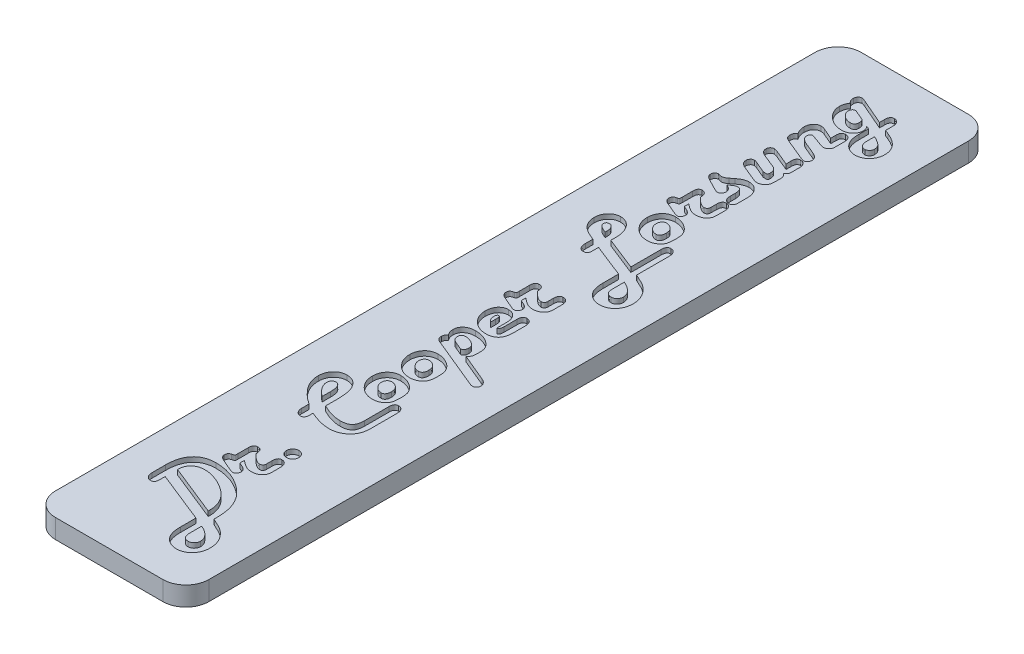
from build123d import *

# Parameters (mm, degrees)
BOSS_EXTRUDE1_DEPTH      = 66.675
BOSS_EXTRUDE1_DEPTH_BACK = 66.675
SKETCH3_W                = 25.4
SKETCH3_H                = 3.175
SKETCH5_OUTSIDE_W        = 54.556
SKETCH5_OUTSIDE_H        = 162.506
CUT_EXTRUDE2_DEPTH       = 68.947967225
CUT_EXTRUDE1_DEPTH       = 0.79375


with BuildPart() as part:
    # Sketch3 → Boss-Extrude1 (new, two sides: drawn at the far end of the back side and taken through both)
    with BuildSketch(Plane.XY.offset(-BOSS_EXTRUDE1_DEPTH_BACK)):
        Rectangle(SKETCH3_W, SKETCH3_H)
    extrude(amount=BOSS_EXTRUDE1_DEPTH + BOSS_EXTRUDE1_DEPTH_BACK)

    # Sketch5 outside → Cut-Extrude2 (cut, through all)
    with BuildSketch(Plane(origin=(0, 1.5875, 0), x_dir=(1, 0, 0), z_dir=(0, 1, 0))):
        Rectangle(SKETCH5_OUTSIDE_W, SKETCH5_OUTSIDE_H)
        with BuildLine():
            Line((12.7, -62.865), (12.7, 62.865))
            ThreePointArc((12.7, 62.865), (11.584076836, 65.559076836), (8.89, 66.675))
            Line((8.89, 66.675), (-8.89, 66.675))
            ThreePointArc((-8.89, 66.675), (-11.584076836, 65.559076836), (-12.7, 62.865))
            Line((-12.7, 62.865), (-12.7, -62.865))
            ThreePointArc((-12.7, -62.865), (-11.584076836, -65.559076836), (-8.89, -66.675))
            Line((-8.89, -66.675), (8.89, -66.675))
            ThreePointArc((8.89, -66.675), (11.584076836, -65.559076836), (12.7, -62.865))
        make_face(mode=Mode.SUBTRACT)
    extrude(amount=-CUT_EXTRUDE2_DEPTH, mode=Mode.SUBTRACT)

    # Sketch4 → Cut-Extrude1 (cut)
    # profile 1 of 16: a face of its own
    with BuildSketch(Plane(origin=(0, 1.5875, 0), x_dir=(1, 0, 0), z_dir=(0, 1, 0))):
        with BuildLine():
            Line((-5.679178082, -51.725171233), (-5.679178082, -52.440068493))
            Line((-5.679178082, -52.440068493), (-5.679178082, -52.63484589))
            add(Edge.make_bspline(
                [(-5.679178082, -52.63484589), (-5.681139035, -52.702031865), (-5.684812377, -52.827887587), (-5.713924446, -53.004101972), (-5.764512562, -53.154860106), (-5.837559677, -53.279472292), (-5.932023683, -53.378342086), (-6.050370432, -53.445545854), (-6.187957449, -53.487377556), (-6.286731391, -53.491167316), (-6.338424658, -53.493150685)],
                knots=[0, 0, 0, 0, 1.305737749, 2.445965353, 3.459324035, 4.379959175, 5.233349143, 6.085046436, 6.997810513, 8, 8, 8, 8], degree=3))
            add(Edge.make_bspline(
                [(-6.338424658, -53.493150685), (-6.405985442, -53.489134678), (-6.539317941, -53.481209013), (-6.730590117, -53.414680999), (-6.900338749, -53.300943843), (-7.049639341, -53.151193025), (-7.170453869, -52.969521798), (-7.259374763, -52.764555636), (-7.314351235, -52.53995592), (-7.320079852, -52.383307764), (-7.323013699, -52.303082192)],
                knots=[0, 0, 0, 0, 0.941902933, 1.858863449, 2.78744378, 3.773831386, 4.79357467, 5.815409039, 6.881186575, 8, 8, 8, 8], degree=3))
            Line((-7.323013699, -52.303082192), (-7.323013699, -52.108304795))
            Line((-7.323013699, -52.108304795), (-7.323013699, -49.991438356))
            add(Edge.make_bspline(
                [(-7.323013699, -49.991438356), (-7.320475549, -49.817239364), (-7.3155453, -49.478865156), (-7.267820653, -48.987359177), (-7.18958523, -48.527017951), (-7.078704255, -48.097981516), (-6.936975313, -47.699686131), (-6.766991285, -47.330627424), (-6.559923115, -46.995561123), (-6.323501854, -46.691529535), (-6.057697159, -46.42058692), (-5.762245196, -46.185576106), (-5.438747353, -45.987265421), (-5.08679158, -45.826810895), (-4.708155717, -45.699834267), (-4.301971757, -45.611316794), (-3.868472678, -45.556438051), (-3.570331213, -45.550832518), (-3.416763699, -45.547945205)],
                knots=[0, 0, 0, 0, 1.240121913, 2.408884614, 3.512215636, 4.562072732, 5.559962685, 6.519078054, 7.449661058, 8.358196616, 9.256317547, 10.145746268, 11.039719344, 11.951275398, 12.894325228, 13.877939151, 14.906963136, 16, 16, 16, 16], degree=3))
            add(Edge.make_bspline(
                [(-3.416763699, -45.547945205), (-3.178865588, -45.553402665), (-2.706260316, -45.564244382), (-2.005222822, -45.660657736), (-1.318852245, -45.811397993), (-0.648003468, -46.025174795), (0.007875584, -46.297601799), (0.646543553, -46.634503168), (1.273595063, -47.027543441), (1.667793593, -47.333816499), (1.867910959, -47.489297945)],
                knots=[0, 0, 0, 0, 0.99369571, 1.974062893, 2.951324249, 3.9272385, 4.912259598, 5.915104549, 6.941589699, 8, 8, 8, 8], degree=3))
            add(Edge.make_bspline(
                [(1.867910959, -47.489297945), (1.978197285, -47.580765654), (2.196111311, -47.761496098), (2.499418667, -48.051513729), (2.779873067, -48.348986907), (3.039382379, -48.654359932), (3.273370418, -48.970457926), (3.486715378, -49.294283847), (3.675652207, -49.627747183), (3.843402214, -49.971374449), (3.989712633, -50.328006855), (4.113540628, -50.701072491), (4.220514455, -51.090322207), (4.308869798, -51.497455776), (4.373145314, -51.921629976), (4.424054428, -52.36196814), (4.450629208, -52.820020779), (4.455387373, -53.131392666), (4.457808219, -53.289811644)],
                knots=[0, 0, 0, 0, 1.041972891, 2.058827374, 3.050103684, 4.014970579, 4.971989252, 5.909071109, 6.834104011, 7.757898592, 8.688895906, 9.635856426, 10.615406742, 11.624176682, 12.664286734, 13.734882699, 14.847559518, 16, 16, 16, 16], degree=3))
            Line((4.457808219, -53.289811644), (4.457808219, -53.799229452))
            Line((4.457808219, -53.799229452), (4.663287671, -53.886986301))
            add(Edge.make_bspline(
                [(4.663287671, -53.886986301), (4.755305177, -53.928408492), (4.932339916, -54.008101661), (5.188267535, -54.122507433), (5.420463771, -54.234785205), (5.633030062, -54.33687823), (5.82373241, -54.432911524), (5.99217766, -54.523339049), (6.141385488, -54.603534644), (6.310069605, -54.707233742), (6.506008189, -54.841386667), (6.734132992, -55.016792933), (6.95674715, -55.21628031), (7.097822135, -55.362258546), (7.169708904, -55.436643836)],
                knots=[0, 0, 0, 0, 1.222800361, 2.352575644, 3.396669397, 4.347862466, 5.210067408, 5.983579217, 6.664594993, 7.262130753, 8.381971782, 9.540587582, 10.746771362, 12, 12, 12, 12], degree=3))
            add(Edge.make_bspline(
                [(7.169708904, -55.436643836), (7.259252012, -55.53791001), (7.435529099, -55.737265459), (7.665799852, -56.05783035), (7.858042816, -56.390630983), (8.019190077, -56.732727855), (8.140760579, -57.087666382), (8.228695229, -57.453783957), (8.284253944, -57.830774747), (8.290354057, -58.086282752), (8.293424658, -58.21489726)],
                knots=[0, 0, 0, 0, 1.055914228, 2.078702545, 3.078046045, 4.055880218, 5.029205391, 6.004237832, 6.995397536, 8, 8, 8, 8], degree=3))
            add(Edge.make_bspline(
                [(8.293424658, -58.21489726), (8.290620622, -58.319852841), (8.285111992, -58.526041891), (8.251873776, -58.827907315), (8.191027588, -59.114953991), (8.107560104, -59.388021275), (8.000632184, -59.64777021), (7.869465324, -59.893048607), (7.714553896, -60.123236539), (7.537138339, -60.336639052), (7.341577706, -60.530357422), (7.131886859, -60.700387417), (6.908215426, -60.843048335), (6.672939661, -60.962041942), (6.422108099, -61.050933428), (6.160276549, -61.118552522), (5.884472994, -61.157164799), (5.696509044, -61.1619478), (5.600787671, -61.164383562)],
                knots=[0, 0, 0, 0, 1.126201464, 2.212463691, 3.25287726, 4.269850786, 5.272053028, 6.261782411, 7.249022054, 8.243830034, 9.23438794, 10.19795826, 11.134388982, 12.075812372, 13.02018767, 13.98375799, 14.973220915, 16, 16, 16, 16], degree=3))
            add(Edge.make_bspline(
                [(5.600787671, -61.164383562), (5.481962949, -61.160841647), (5.246551589, -61.153824531), (4.901392086, -61.080074536), (4.565645333, -60.972460663), (4.247078567, -60.81543267), (3.950050697, -60.622261328), (3.685416052, -60.39393496), (3.453108861, -60.134286952), (3.329976245, -59.938452387), (3.267739726, -59.839469178)],
                knots=[0, 0, 0, 0, 1.014242392, 2.009381349, 3.004557683, 4.021967388, 5.035219112, 6.025505851, 7.00200576, 8, 8, 8, 8], degree=3))
            add(Edge.make_bspline(
                [(3.267739726, -59.839469178), (3.230782911, -59.770883498), (3.155401117, -59.630987469), (3.064407715, -59.404675982), (2.987950753, -59.161796409), (2.922935082, -58.901818464), (2.875444298, -58.624034115), (2.838346721, -58.329172715), (2.817034776, -58.016870731), (2.815010595, -57.802543269), (2.813972603, -57.692636986)],
                knots=[0, 0, 0, 0, 0.84245226, 1.718372183, 2.633912599, 3.596293803, 4.615457363, 5.681185209, 6.810920853, 8, 8, 8, 8], degree=3))
            Line((2.813972603, -57.692636986), (2.813972603, -55.128424658))
            Line((2.813972603, -55.128424658), (-5.679178082, -51.725171233))
        make_face()
        with BuildLine():
            Line((2.813972603, -53.097174658), (2.813972603, -52.808219178))
            add(Edge.make_bspline(
                [(2.813972603, -52.808219178), (2.812229985, -52.715413987), (2.808779397, -52.531648868), (2.784155566, -52.258717703), (2.746792266, -51.991103422), (2.6903681, -51.729692316), (2.619740112, -51.474520953), (2.534172231, -51.224633325), (2.430309071, -50.980882243), (2.314188361, -50.740790222), (2.17712634, -50.509242988), (2.028104247, -50.282030043), (1.861775087, -50.061495191), (1.683460875, -49.84422437), (1.483489685, -49.637439359), (1.273647666, -49.430732234), (1.042967987, -49.234365248), (0.88166229, -49.108975874), (0.79984589, -49.045376712)],
                knots=[0, 0, 0, 0, 1.003752549, 1.98754731, 2.96218803, 3.924869515, 4.877913061, 5.824875223, 6.779479857, 7.742439712, 8.707376773, 9.687714611, 10.680189018, 11.694008127, 12.725763052, 13.790025714, 14.879071578, 16, 16, 16, 16], degree=3))
            add(Edge.make_bspline(
                [(0.79984589, -49.045376712), (0.637495563, -48.92719295), (0.31362577, -48.691430257), (-0.202532711, -48.38493724), (-0.736886345, -48.113288115), (-1.286214939, -47.885272589), (-1.833665188, -47.6995754), (-2.367354317, -47.565352513), (-2.880398896, -47.48127963), (-3.216699298, -47.470836228), (-3.380376712, -47.465753425)],
                knots=[0, 0, 0, 0, 1.061151743, 2.116872814, 3.169496409, 4.227969904, 5.258553914, 6.222792805, 7.135033211, 8, 8, 8, 8], degree=3))
            add(Edge.make_bspline(
                [(-3.380376712, -47.465753425), (-3.46678892, -47.467146718), (-3.635806387, -47.469871921), (-3.882804511, -47.498512158), (-4.115991615, -47.544225384), (-4.334080712, -47.611915609), (-4.538944612, -47.695032065), (-4.730305436, -47.79774106), (-4.906157833, -47.920722958), (-5.067898235, -48.059693115), (-5.2103847, -48.216965692), (-5.338824533, -48.38577569), (-5.442726671, -48.57112789), (-5.529114219, -48.768332376), (-5.598907159, -48.978609622), (-5.64329496, -49.203783202), (-5.675977303, -49.441116241), (-5.678092042, -49.603900778), (-5.679178082, -49.6875)],
                knots=[0, 0, 0, 0, 1.145531499, 2.240595844, 3.292755274, 4.292422607, 5.264114043, 6.220902991, 7.165828125, 8.104908158, 9.042461542, 9.975419986, 10.911970153, 11.852526766, 12.827988561, 13.843075609, 14.892295267, 16, 16, 16, 16], degree=3))
            Line((-5.679178082, -49.6875), (2.813972603, -53.097174658))
        make_face(mode=Mode.SUBTRACT)
        with BuildLine():
            Line((4.457808219, -55.828339041), (4.457808219, -57.744006849))
            add(Edge.make_bspline(
                [(4.457808219, -57.744006849), (4.460994809, -57.851224943), (4.466957488, -58.051849157), (4.512836115, -58.332607159), (4.591499209, -58.572387336), (4.709872635, -58.768025513), (4.858337145, -58.924864896), (5.044659494, -59.033393198), (5.262554621, -59.09917104), (5.418357057, -59.10600151), (5.500188356, -59.109589041)],
                knots=[0, 0, 0, 0, 1.31364871, 2.458071474, 3.475829816, 4.38621616, 5.23967168, 6.094559773, 6.99921559, 8, 8, 8, 8], degree=3))
            add(Edge.make_bspline(
                [(5.500188356, -59.109589041), (5.569155028, -59.106179577), (5.703961188, -59.099515246), (5.896015584, -59.038378173), (6.072433285, -58.94310595), (6.223360846, -58.806845603), (6.353187059, -58.648040007), (6.446221691, -58.465692393), (6.501322507, -58.265858339), (6.508778068, -58.127489487), (6.51260274, -58.056506849)],
                knots=[0, 0, 0, 0, 1.015443884, 1.984844108, 2.946375274, 3.953924431, 4.965428653, 5.959234333, 6.953095811, 8, 8, 8, 8], degree=3))
            add(Edge.make_bspline(
                [(6.51260274, -58.056506849), (6.510944819, -58.002188975), (6.507632271, -57.89366118), (6.481106386, -57.73211867), (6.436939997, -57.572921581), (6.380697586, -57.413945211), (6.301924225, -57.259157604), (6.206309798, -57.107291683), (6.098402384, -56.953987159), (5.922661518, -56.756046963), (5.670783127, -56.515524097), (5.316162311, -56.256945079), (4.909349592, -56.021931541), (4.611992169, -55.894443407), (4.457808219, -55.828339041)],
                knots=[0, 0, 0, 0, 0.609246736, 1.21728261, 1.830931323, 2.461525313, 3.105941494, 3.774613737, 4.474427454, 5.206422339, 6.740961797, 8.372497183, 10.119089455, 12, 12, 12, 12], degree=3))
        make_face(mode=Mode.SUBTRACT)
    # profile 2 of 16: a face of its own
    with BuildSketch(Plane(origin=(0, 1.5875, 0), x_dir=(1, 0, 0), z_dir=(0, 1, 0))):
        with BuildLine():
            Line((-1.43260274, -43.610873288), (-0.846130137, -43.865582192))
            add(Edge.make_bspline(
                [(-0.846130137, -43.865582192), (-0.784113415, -43.894300642), (-0.665976306, -43.949007093), (-0.507163435, -44.046730925), (-0.36948265, -44.146728687), (-0.257336482, -44.255974718), (-0.16943101, -44.372552179), (-0.108767407, -44.496943349), (-0.07035756, -44.627450334), (-0.065291412, -44.717206532), (-0.062739726, -44.762414384)],
                knots=[0, 0, 0, 0, 1.297501196, 2.471640463, 3.537215363, 4.524637192, 5.43567625, 6.296618738, 7.14205136, 8, 8, 8, 8], degree=3))
            add(Edge.make_bspline(
                [(-0.062739726, -44.762414384), (-0.064249291, -44.816182298), (-0.067186018, -44.920783085), (-0.105649348, -45.0694785), (-0.163102956, -45.206333115), (-0.246876118, -45.32378118), (-0.34425513, -45.424073782), (-0.457491489, -45.49671737), (-0.583595576, -45.538757147), (-0.671025425, -45.54484424), (-0.715565068, -45.547945205)],
                knots=[0, 0, 0, 0, 1.131994738, 2.202197021, 3.220602635, 4.248319073, 5.22801886, 6.155513921, 7.060358075, 8, 8, 8, 8], degree=3))
            add(Edge.make_bspline(
                [(-0.715565068, -45.547945205), (-0.747081309, -45.54515332), (-0.820370025, -45.538660994), (-0.942225513, -45.506057826), (-1.090708332, -45.452937415), (-1.198044875, -45.40928596), (-1.257089041, -45.385273973)],
                knots=[0, 0, 0, 0, 0.667539348, 1.552314029, 2.65356594, 4, 4, 4, 4], degree=3))
            Line((-1.257089041, -45.385273973), (-3.19630137, -44.55265411))
            add(Edge.make_bspline(
                [(-3.19630137, -44.55265411), (-3.251910738, -44.527542728), (-3.358097521, -44.479592231), (-3.500931864, -44.389948755), (-3.62350436, -44.29500323), (-3.724073706, -44.190743298), (-3.802724918, -44.079204127), (-3.856319972, -43.958228287), (-3.893260946, -43.830657664), (-3.896639037, -43.741705345), (-3.898356164, -43.696489726)],
                knots=[0, 0, 0, 0, 1.242093141, 2.371792344, 3.427691145, 4.394328043, 5.313892613, 6.192305435, 7.081125362, 8, 8, 8, 8], degree=3))
            add(Edge.make_bspline(
                [(-3.898356164, -43.696489726), (-3.896510838, -43.652885719), (-3.893007731, -43.570109282), (-3.872120133, -43.451388415), (-3.833957565, -43.346139358), (-3.779281238, -43.254113402), (-3.709475187, -43.174734568), (-3.622457216, -43.111420161), (-3.521903931, -43.057890273), (-3.447254499, -43.035903136), (-3.408202055, -43.024400685)],
                knots=[0, 0, 0, 0, 1.15314347, 2.189090296, 3.173792814, 4.095790583, 5.004376053, 5.947550008, 6.926271946, 8, 8, 8, 8], degree=3))
            Line((-3.408202055, -43.024400685), (-3.192020548, -42.964469178))
            add(Edge.make_bspline(
                [(-3.192020548, -42.964469178), (-3.166012398, -42.957534426), (-3.118375193, -42.944832553), (-3.056598309, -42.914357521), (-3.010020126, -42.878662157), (-2.976955035, -42.830502205), (-2.959433608, -42.762806915), (-2.948144639, -42.668769531), (-2.939675458, -42.543646295), (-2.939531558, -42.449354971), (-2.939452055, -42.397260274)],
                knots=[0, 0, 0, 0, 0.926850573, 1.697643703, 2.362895762, 2.92973869, 3.677374781, 4.746381598, 6.202419277, 8, 8, 8, 8], degree=3))
            Line((-2.939452055, -42.397260274), (-2.939452055, -40.706335616))
            add(Edge.make_bspline(
                [(-2.939452055, -40.706335616), (-2.937570141, -40.634862183), (-2.934050522, -40.501190157), (-2.904069677, -40.31407635), (-2.856572636, -40.154489854), (-2.788575116, -40.021262515), (-2.695673752, -39.919243603), (-2.582883881, -39.846500402), (-2.450261525, -39.802409732), (-2.35546974, -39.797229819), (-2.305890411, -39.794520548)],
                knots=[0, 0, 0, 0, 1.361355543, 2.546053047, 3.599677592, 4.524244374, 5.371169927, 6.197098625, 7.057021238, 8, 8, 8, 8], degree=3))
            add(Edge.make_bspline(
                [(-2.305890411, -39.794520548), (-2.236908431, -39.796949589), (-2.105643936, -39.801571765), (-1.923598266, -39.859729665), (-1.766736412, -39.950718724), (-1.643256267, -40.085088585), (-1.544572999, -40.252398311), (-1.478735842, -40.456862673), (-1.43796965, -40.696141852), (-1.434471998, -40.867385791), (-1.43260274, -40.95890411)],
                knots=[0, 0, 0, 0, 0.994284648, 1.892005291, 2.734571892, 3.588753721, 4.500369607, 5.525254763, 6.677415825, 8, 8, 8, 8], degree=3))
            Line((-1.43260274, -40.95890411), (-1.361969178, -41.033818493))
            add(Edge.make_bspline(
                [(-1.361969178, -41.033818493), (-1.275640685, -41.119462816), (-1.110395067, -41.283398828), (-0.863701621, -41.505414242), (-0.631112245, -41.692806714), (-0.416532555, -41.848956104), (-0.213839595, -41.967871916), (-0.028186714, -42.054673771), (0.143696282, -42.111830906), (0.25510596, -42.119620683), (0.30755137, -42.123287671)],
                knots=[0, 0, 0, 0, 1.435762249, 2.748263184, 3.91660617, 4.961556361, 5.879059361, 6.685751502, 7.381325737, 8, 8, 8, 8], degree=3))
            add(Edge.make_bspline(
                [(0.30755137, -42.123287671), (0.353486324, -42.122379854), (0.440770679, -42.120654845), (0.561359469, -42.088044475), (0.668100093, -42.046230473), (0.75127153, -41.975827185), (0.818376722, -41.889633778), (0.864001338, -41.783590753), (0.892910502, -41.659631871), (0.89503041, -41.571249666), (0.896164384, -41.523972603)],
                knots=[0, 0, 0, 0, 1.140484469, 2.167117703, 3.098941929, 3.971150526, 4.846255631, 5.80154673, 6.824011975, 8, 8, 8, 8], degree=3))
            Line((0.896164384, -41.523972603), (0.896164384, -40.612157534))
            add(Edge.make_bspline(
                [(0.896164384, -40.612157534), (0.898182521, -40.537161029), (0.901949312, -40.397182347), (0.930142152, -40.200657935), (0.983520387, -40.034472536), (1.055151224, -39.895968918), (1.150718895, -39.788258794), (1.267698419, -39.711032515), (1.407306267, -39.664859554), (1.50724529, -39.660055396), (1.559691781, -39.657534247)],
                knots=[0, 0, 0, 0, 1.364190584, 2.546219988, 3.596843527, 4.525897283, 5.362221888, 6.186477391, 7.048290713, 8, 8, 8, 8], degree=3))
            add(Edge.make_bspline(
                [(1.559691781, -39.657534247), (1.633666212, -39.66140898), (1.775914151, -39.668859837), (1.975742682, -39.732546695), (2.149287601, -39.838279268), (2.291023797, -39.988168929), (2.40652937, -40.172404802), (2.482997056, -40.393434479), (2.533984606, -40.64407099), (2.537926761, -40.822341022), (2.54, -40.91609589)],
                knots=[0, 0, 0, 0, 0.982615473, 1.889504555, 2.759142238, 3.658944971, 4.610088785, 5.631441668, 6.75433984, 8, 8, 8, 8], degree=3))
            Line((2.54, -40.91609589), (2.54, -42.333047945))
            add(Edge.make_bspline(
                [(2.54, -42.333047945), (2.5383024, -42.389505233), (2.534977996, -42.50006532), (2.510384601, -42.66201107), (2.472968238, -42.816820881), (2.416521678, -42.963012983), (2.344926398, -43.101132479), (2.259558563, -43.232841881), (2.155710436, -43.354659896), (2.038215237, -43.46807492), (1.907947493, -43.569879575), (1.768882381, -43.660660136), (1.61926785, -43.735791742), (1.461132501, -43.798144302), (1.292391004, -43.845025714), (1.114822727, -43.878641974), (0.928132827, -43.901205408), (0.800627218, -43.903129048), (0.735633562, -43.904109589)],
                knots=[0, 0, 0, 0, 1.009407673, 1.976719137, 2.923785669, 3.852797958, 4.771676065, 5.702527031, 6.65345443, 7.628144937, 8.618662201, 9.606215811, 10.593522047, 11.607757909, 12.641947342, 13.720607507, 14.838121302, 16, 16, 16, 16], degree=3))
            add(Edge.make_bspline(
                [(0.735633562, -43.904109589), (0.651262954, -43.901073935), (0.482172253, -43.894990054), (0.230972093, -43.850313577), (-0.017070175, -43.780013001), (-0.265153047, -43.675746777), (-0.523447633, -43.533453284), (-0.803548993, -43.349700863), (-1.111236787, -43.121962049), (-1.32133514, -42.950431318), (-1.43260274, -42.859589041)],
                knots=[0, 0, 0, 0, 0.822710096, 1.64882809, 2.481516469, 3.333299355, 4.267584386, 5.354441073, 6.598918144, 8, 8, 8, 8], degree=3))
            Line((-1.43260274, -42.859589041), (-1.43260274, -43.610873288))
        make_face()
    # profile 3 of 16: a face of its own
    with BuildSketch(Plane(origin=(0, 1.5875, 0), x_dir=(1, 0, 0), z_dir=(0, 1, 0))):
        with BuildLine():
            add(Edge.make_bspline(
                [(0.622191781, -37.940924658), (0.625798096, -37.872726126), (0.632835998, -37.739633298), (0.691439504, -37.547816369), (0.787228625, -37.371388996), (0.920147512, -37.21576395), (1.075772557, -37.082845063), (1.252199931, -36.987055942), (1.44401686, -36.928452436), (1.577109688, -36.921414534), (1.645308219, -36.917808219)],
                knots=[0, 0, 0, 0, 1.018015329, 1.986707578, 2.970091954, 4, 5.029908046, 6.013292422, 6.981984671, 8, 8, 8, 8], degree=3))
            add(Edge.make_bspline(
                [(1.645308219, -36.917808219), (1.714197217, -36.921495108), (1.849331034, -36.928727371), (2.044134079, -36.986612921), (2.223061144, -37.08222156), (2.378993595, -37.215822129), (2.511958868, -37.371374188), (2.607736163, -37.54782017), (2.66634272, -37.739632298), (2.673380202, -37.872725787), (2.676986301, -37.940924658)],
                knots=[0, 0, 0, 0, 1.023458974, 2.007634331, 2.995409192, 4.02013336, 5.044857529, 6.023292197, 6.987108688, 8, 8, 8, 8], degree=3))
            add(Edge.make_bspline(
                [(2.676986301, -37.940924658), (2.673299631, -38.009814), (2.666067797, -38.144948492), (2.608179119, -38.339746613), (2.512582459, -38.518692533), (2.378935452, -38.67455189), (2.223076095, -38.808198898), (2.044130175, -38.903795558), (1.849332054, -38.961684236), (1.714197562, -38.96891607), (1.645308219, -38.97260274)],
                knots=[0, 0, 0, 0, 1.018333356, 1.997579833, 2.980407786, 4, 5.019592214, 6.002420167, 6.981666644, 8, 8, 8, 8], degree=3))
            add(Edge.make_bspline(
                [(1.645308219, -38.97260274), (1.577109349, -38.96899664), (1.44401586, -38.961959158), (1.252203731, -38.903352601), (1.07575775, -38.807575306), (0.92020569, -38.674610033), (0.786605121, -38.518677583), (0.690996483, -38.339750517), (0.633110933, -38.144947472), (0.62587867, -38.009813656), (0.622191781, -37.940924658)],
                knots=[0, 0, 0, 0, 1.012891312, 1.976707803, 2.955142471, 3.97986664, 5.004590808, 5.992365669, 6.976541026, 8, 8, 8, 8], degree=3))
        make_face()
    # profile 4 of 16: a face of its own
    with BuildSketch(Plane(origin=(0, 1.5875, 0), x_dir=(1, 0, 0), z_dir=(0, 1, 0))):
        with BuildLine():
            add(Edge.make_bspline(
                [(-2.528493151, -28.321917808), (-2.381451474, -28.39533593), (-2.093160139, -28.539280211), (-1.658362689, -28.727884187), (-1.231015239, -28.886917454), (-0.812567052, -29.018075606), (-0.401456952, -29.119261316), (0.001508443, -29.192933547), (0.397182413, -29.236913329), (0.658476266, -29.243389698), (0.787003425, -29.246575342)],
                knots=[0, 0, 0, 0, 1.135220372, 2.225724058, 3.27216563, 4.283906486, 5.253382005, 6.19501987, 7.112152981, 8, 8, 8, 8], degree=3))
            add(Edge.make_bspline(
                [(0.787003425, -29.246575342), (0.874113697, -29.245828483), (1.042975432, -29.244380709), (1.285967888, -29.219580303), (1.510798668, -29.184120352), (1.71614208, -29.133908255), (1.901449634, -29.066838183), (2.069172576, -28.987990733), (2.216693157, -28.891990128), (2.345852371, -28.780061028), (2.459888494, -28.65276441), (2.552257576, -28.502556742), (2.635542637, -28.336421267), (2.700188334, -28.149771046), (2.752275951, -27.94431469), (2.786641773, -27.719210078), (2.811920652, -27.474884647), (2.813272483, -27.305296339), (2.813972603, -27.217465753)],
                knots=[0, 0, 0, 0, 1.252677985, 2.428294313, 3.509996311, 4.525739813, 5.464108595, 6.341009018, 7.186590139, 7.98710898, 8.794377844, 9.634395665, 10.515790431, 11.463822145, 12.469610459, 13.561444014, 14.737060343, 16, 16, 16, 16], degree=3))
            Line((2.813972603, -27.217465753), (2.813972603, -23.199914384))
            add(Edge.make_bspline(
                [(2.813972603, -23.199914384), (2.815823106, -23.126276866), (2.819290347, -22.988304158), (2.849695167, -22.795860247), (2.895144059, -22.630119647), (2.97043148, -22.496673466), (3.061710652, -22.388969177), (3.175967737, -22.311703045), (3.312562517, -22.268169679), (3.409402655, -22.262996825), (3.460376712, -22.260273973)],
                knots=[0, 0, 0, 0, 1.364812008, 2.557212865, 3.608126562, 4.532400877, 5.376541846, 6.206135691, 7.055757818, 8, 8, 8, 8], degree=3))
            add(Edge.make_bspline(
                [(3.460376712, -22.260273973), (3.535085119, -22.264062251), (3.678087557, -22.27131355), (3.879976633, -22.336004484), (4.056103631, -22.442550532), (4.200359811, -22.595163188), (4.317782569, -22.782425651), (4.399902419, -23.006062389), (4.448900311, -23.262725197), (4.454731832, -23.444398797), (4.457808219, -23.540239726)],
                knots=[0, 0, 0, 0, 0.976305263, 1.868786103, 2.745423265, 3.644143942, 4.593054588, 5.622217833, 6.745613821, 8, 8, 8, 8], degree=3))
            Line((4.457808219, -23.540239726), (4.457808219, -27.729023973))
            add(Edge.make_bspline(
                [(4.457808219, -27.729023973), (4.457299294, -27.81467275), (4.456306046, -27.981829794), (4.439505331, -28.225849064), (4.41975947, -28.457457718), (4.388319899, -28.675624048), (4.343712752, -28.87997493), (4.296715093, -29.072448286), (4.236463051, -29.25112544), (4.18813891, -29.363167104), (4.164571918, -29.417808219)],
                knots=[0, 0, 0, 0, 1.190131533, 2.322728638, 3.398279404, 4.420629422, 5.383336324, 6.304493289, 7.173125649, 8, 8, 8, 8], degree=3))
            add(Edge.make_bspline(
                [(4.164571918, -29.417808219), (4.12927286, -29.489737107), (4.059405033, -29.632106778), (3.935970799, -29.834506191), (3.798723956, -30.025660794), (3.646847073, -30.205164331), (3.481584179, -30.372643158), (3.3026005, -30.527836406), (3.109535479, -30.670686867), (2.905050494, -30.80345598), (2.689680119, -30.920932078), (2.464924286, -31.020944547), (2.234644049, -31.110983193), (1.993565054, -31.176815767), (1.747706306, -31.234432283), (1.493524727, -31.271795472), (1.231974364, -31.296224172), (1.054611948, -31.299638294), (0.964657534, -31.301369863)],
                knots=[0, 0, 0, 0, 0.978934421, 1.937616086, 2.893596785, 3.852754301, 4.808575882, 5.766781459, 6.745249647, 7.741853776, 8.744771607, 9.740039421, 10.747458991, 11.763260868, 12.791452619, 13.832398251, 14.900638884, 16, 16, 16, 16], degree=3))
            add(Edge.make_bspline(
                [(0.964657534, -31.301369863), (0.839706148, -31.297996563), (0.583493912, -31.291079626), (0.190123601, -31.24887218), (-0.220325796, -31.178462531), (-0.647902093, -31.074583387), (-1.094645889, -30.950462691), (-1.557747603, -30.791343758), (-2.039460853, -30.608393837), (-2.362802347, -30.467946075), (-2.528493151, -30.395976027)],
                knots=[0, 0, 0, 0, 0.825343589, 1.692363183, 2.610426493, 3.574010669, 4.597411306, 5.671867218, 6.806988276, 8, 8, 8, 8], degree=3))
            Line((-2.528493151, -30.395976027), (-2.528493151, -30.800513699))
            Line((-2.528493151, -30.800513699), (-2.528493151, -30.988869863))
            add(Edge.make_bspline(
                [(-2.528493151, -30.988869863), (-2.530501184, -31.05605286), (-2.534283744, -31.182606405), (-2.563062627, -31.359544006), (-2.613254321, -31.510639456), (-2.687477034, -31.633947832), (-2.781878451, -31.732080248), (-2.899000685, -31.802181179), (-3.037367494, -31.843376754), (-3.136079088, -31.84727495), (-3.187739726, -31.849315068)],
                knots=[0, 0, 0, 0, 1.304291175, 2.456911397, 3.46914742, 4.376890703, 5.229335235, 6.087167935, 6.998920798, 8, 8, 8, 8], degree=3))
            add(Edge.make_bspline(
                [(-3.187739726, -31.849315068), (-3.254747446, -31.845685072), (-3.386571057, -31.838543815), (-3.573333774, -31.766626555), (-3.744859157, -31.657191352), (-3.894497133, -31.50493703), (-4.01755869, -31.321529194), (-4.108333435, -31.115925476), (-4.16383445, -30.891167643), (-4.16944341, -30.735199025), (-4.172328767, -30.654965753)],
                knots=[0, 0, 0, 0, 0.931926633, 1.833369871, 2.756466935, 3.756871954, 4.790367599, 5.825255028, 6.881269148, 8, 8, 8, 8], degree=3))
            Line((-4.172328767, -30.654965753), (-4.172328767, -30.460188356))
            Line((-4.172328767, -30.460188356), (-4.172328767, -29.413527397))
            add(Edge.make_bspline(
                [(-4.172328767, -29.413527397), (-4.349965015, -29.298051509), (-4.7128797, -29.062131778), (-5.227847246, -28.644159805), (-5.739326425, -28.178138414), (-6.057764434, -27.831484605), (-6.220702055, -27.654109589)],
                knots=[0, 0, 0, 0, 0.937855809, 1.916059648, 2.933694244, 4, 4, 4, 4], degree=3))
            add(Edge.make_bspline(
                [(-6.220702055, -27.654109589), (-6.319973512, -27.537404433), (-6.514711002, -27.30846784), (-6.763759522, -26.941393644), (-6.980635425, -26.571830181), (-7.154137375, -26.191855113), (-7.293121873, -25.806527772), (-7.388675845, -25.412503286), (-7.449061744, -25.012578114), (-7.456345773, -24.743363477), (-7.46, -24.608304795)],
                knots=[0, 0, 0, 0, 1.092661291, 2.143437016, 3.160869329, 4.147355701, 5.120066962, 6.07960259, 7.036581562, 8, 8, 8, 8], degree=3))
            add(Edge.make_bspline(
                [(-7.46, -24.608304795), (-7.457911144, -24.520451469), (-7.453822804, -24.348503659), (-7.422740231, -24.096592207), (-7.374780601, -23.855413283), (-7.302810119, -23.626944508), (-7.216213889, -23.407427338), (-7.103366293, -23.203214526), (-6.974579421, -23.007945017), (-6.825402114, -22.827812728), (-6.661483458, -22.663497345), (-6.48503852, -22.518247315), (-6.296152905, -22.396967264), (-6.097791711, -22.294177836), (-5.886940123, -22.217045765), (-5.664685238, -22.16505972), (-5.432809831, -22.128369504), (-5.274075693, -22.125001473), (-5.193304795, -22.123287671)],
                knots=[0, 0, 0, 0, 1.119527251, 2.191155048, 3.230976227, 4.249298308, 5.240622722, 6.233531056, 7.217233973, 8.218643922, 9.208966661, 10.171979194, 11.125497735, 12.065035589, 13.014512214, 13.978426103, 14.971334436, 16, 16, 16, 16], degree=3))
            add(Edge.make_bspline(
                [(-5.193304795, -22.123287671), (-5.078838535, -22.127190213), (-4.85514808, -22.134816575), (-4.530564727, -22.200663597), (-4.227580088, -22.308970334), (-3.943236452, -22.457939058), (-3.680502861, -22.652139072), (-3.442510318, -22.891909479), (-3.220564302, -23.170034005), (-3.097391082, -23.380118872), (-3.033630137, -23.488869863)],
                knots=[0, 0, 0, 0, 1.018804761, 1.990952639, 2.935710558, 3.876656104, 4.840123917, 5.833253974, 6.878378157, 8, 8, 8, 8], degree=3))
            add(Edge.make_bspline(
                [(-3.033630137, -23.488869863), (-2.992727739, -23.570907855), (-2.907074777, -23.742702113), (-2.806608169, -24.028262724), (-2.719153439, -24.346474638), (-2.649966948, -24.699397998), (-2.594097455, -25.085076022), (-2.557296683, -25.505272104), (-2.533365076, -25.959339668), (-2.530155395, -26.273511172), (-2.528493151, -26.436215753)],
                knots=[0, 0, 0, 0, 0.728556699, 1.525657243, 2.402672044, 3.352039263, 4.384154211, 5.50114961, 6.705883877, 8, 8, 8, 8], degree=3))
            Line((-2.528493151, -26.436215753), (-2.528493151, -28.321917808))
        make_face()
        with BuildLine():
            Line((-4.172328767, -27.245291096), (-4.172328767, -25.845462329))
            add(Edge.make_bspline(
                [(-4.172328767, -25.845462329), (-4.173341358, -25.772682387), (-4.175308085, -25.631324014), (-4.184935525, -25.426957413), (-4.205312856, -25.236467357), (-4.229318295, -25.059622767), (-4.264266148, -24.896931482), (-4.30362276, -24.748237514), (-4.353783369, -24.614876969), (-4.408869559, -24.493879085), (-4.472047143, -24.387011333), (-4.544931266, -24.295146381), (-4.622405863, -24.215554916), (-4.710555697, -24.152251038), (-4.805187861, -24.103144538), (-4.907041893, -24.065781718), (-5.016878244, -24.044194091), (-5.092611909, -24.042142245), (-5.131232877, -24.04109589)],
                knots=[0, 0, 0, 0, 1.530225532, 2.972112734, 4.29893874, 5.556827136, 6.721764215, 7.795238361, 8.787123859, 9.713203311, 10.587806911, 11.388973238, 12.173826602, 12.91489056, 13.659588691, 14.409255044, 15.188787307, 16, 16, 16, 16], degree=3))
            add(Edge.make_bspline(
                [(-5.131232877, -24.04109589), (-5.179342248, -24.04401542), (-5.273297335, -24.04971711), (-5.408559201, -24.093747285), (-5.527650312, -24.171108773), (-5.630913341, -24.274945471), (-5.713399703, -24.401350068), (-5.77460971, -24.544594642), (-5.808442725, -24.704507968), (-5.813520077, -24.815770006), (-5.816164384, -24.873715753)],
                knots=[0, 0, 0, 0, 0.957212062, 1.869385084, 2.795725007, 3.760291457, 4.765249107, 5.783975308, 6.845884806, 8, 8, 8, 8], degree=3))
            add(Edge.make_bspline(
                [(-5.816164384, -24.873715753), (-5.810474434, -24.969166366), (-5.798719453, -25.166359695), (-5.708166102, -25.464805818), (-5.564093857, -25.771129136), (-5.369433677, -26.085096234), (-5.129010022, -26.396827736), (-4.846769283, -26.697155793), (-4.526627805, -26.982848255), (-4.292203498, -27.156495301), (-4.172328767, -27.245291096)],
                knots=[0, 0, 0, 0, 0.767354421, 1.585292851, 2.48966922, 3.487312267, 4.551994222, 5.652958552, 6.799821728, 8, 8, 8, 8], degree=3))
        make_face(mode=Mode.SUBTRACT)
    # profile 5 of 16: a face of its own
    with BuildSketch(Plane(origin=(0, 1.5875, 0), x_dir=(1, 0, 0), z_dir=(0, 1, 0))):
        with BuildLine():
            add(Edge.make_bspline(
                [(-2.939452055, -20.147688356), (-2.937340599, -20.061973584), (-2.933192491, -19.893580767), (-2.902269882, -19.647361043), (-2.854686397, -19.411477813), (-2.780142599, -19.189628195), (-2.690838506, -18.977178424), (-2.578837068, -18.778143327), (-2.447212585, -18.590043706), (-2.296182473, -18.416154482), (-2.129262976, -18.257631488), (-1.950450091, -18.11841789), (-1.759077595, -18.001640912), (-1.558781037, -17.904776995), (-1.345711617, -17.832035566), (-1.12298144, -17.778439558), (-0.888483059, -17.745606153), (-0.728513502, -17.741709725), (-0.647071918, -17.739726027)],
                knots=[0, 0, 0, 0, 1.103971081, 2.168830371, 3.192796702, 4.19853072, 5.178566245, 6.157954981, 7.134622528, 8.13162389, 9.119900924, 10.09617911, 11.045205717, 12.003137743, 12.956605303, 13.939782458, 14.951129296, 16, 16, 16, 16], degree=3))
            add(Edge.make_bspline(
                [(-0.647071918, -17.739726027), (-0.521208599, -17.743707615), (-0.26845337, -17.75170333), (0.10860876, -17.821517305), (0.483392704, -17.933104986), (0.849112365, -18.08994559), (1.199072078, -18.275547162), (1.515078635, -18.496198151), (1.797932159, -18.738819122), (1.955122318, -18.925427937), (2.032722603, -19.01755137)],
                knots=[0, 0, 0, 0, 0.985331903, 1.97871623, 2.993784644, 4.043324233, 5.09119552, 6.091271912, 7.057715548, 8, 8, 8, 8], degree=3))
            add(Edge.make_bspline(
                [(2.032722603, -19.01755137), (2.078036022, -19.080319846), (2.166772773, -19.203238638), (2.279300317, -19.396831774), (2.366701041, -19.594652357), (2.436676678, -19.800471851), (2.483201963, -20.029867655), (2.51584338, -20.292435811), (2.537568814, -20.595393126), (2.539156807, -20.810460793), (2.54, -20.924657534)],
                knots=[0, 0, 0, 0, 0.921254077, 1.804081356, 2.659560611, 3.492177375, 4.386734262, 5.440228603, 6.640811263, 8, 8, 8, 8], degree=3))
            add(Edge.make_bspline(
                [(2.54, -20.924657534), (2.5392631, -21.019565512), (2.537855038, -21.200914659), (2.524992177, -21.460815808), (2.504199699, -21.696558764), (2.474647226, -21.908816315), (2.437251353, -22.097224597), (2.390095481, -22.261136749), (2.336383521, -22.402327882), (2.288481844, -22.483400441), (2.266027397, -22.52140411)],
                knots=[0, 0, 0, 0, 1.39041541, 2.656790854, 3.811370106, 4.856520238, 5.795436321, 6.622484863, 7.354274382, 8, 8, 8, 8], degree=3))
            add(Edge.make_bspline(
                [(2.266027397, -22.52140411), (2.210706866, -22.598427019), (2.101763773, -22.750108748), (1.910023297, -22.950837014), (1.69694738, -23.118642464), (1.464464612, -23.254714234), (1.214537303, -23.36260617), (0.944283837, -23.440084686), (0.654374304, -23.484864895), (0.454682473, -23.490345999), (0.3525, -23.493150685)],
                knots=[0, 0, 0, 0, 1.013819869, 1.996522248, 2.958697901, 3.90662464, 4.870948177, 5.864004237, 6.907009222, 8, 8, 8, 8], degree=3))
            add(Edge.make_bspline(
                [(0.3525, -23.493150685), (0.243155158, -23.490521573), (0.026282159, -23.48530703), (-0.292644085, -23.436099001), (-0.600984711, -23.360353369), (-0.896271579, -23.248594896), (-1.182209346, -23.110478934), (-1.454805294, -22.936812213), (-1.717534066, -22.734702098), (-1.964930964, -22.503399577), (-2.19156019, -22.251050712), (-2.393260767, -21.985396545), (-2.558992557, -21.705227845), (-2.70100172, -21.417458188), (-2.808651784, -21.115778671), (-2.881435108, -20.802439691), (-2.93202876, -20.478939371), (-2.936953343, -20.259188833), (-2.939452055, -20.147688356)],
                knots=[0, 0, 0, 0, 1.007797798, 1.998851768, 2.969155317, 3.931055872, 4.905122675, 5.892763132, 6.906173297, 7.958361136, 9.01137164, 10.031276384, 11.028840275, 12.008823124, 12.987014998, 13.974918451, 14.972482342, 16, 16, 16, 16], degree=3))
        make_face()
        with BuildLine():
            add(Edge.make_bspline(
                [(-1.295616438, -20.314640411), (-1.290413225, -20.409454813), (-1.279986727, -20.599449386), (-1.18975315, -20.876059594), (-1.041572634, -21.136874778), (-0.845828043, -21.377120343), (-0.61764031, -21.584016763), (-0.366238139, -21.73559289), (-0.102387694, -21.832088286), (0.079892321, -21.843592468), (0.170565068, -21.849315068)],
                knots=[0, 0, 0, 0, 0.975806903, 1.955378207, 2.966488235, 4.054561247, 5.138397878, 6.125043581, 7.067328091, 8, 8, 8, 8], degree=3))
            add(Edge.make_bspline(
                [(0.170565068, -21.849315068), (0.227398075, -21.847200037), (0.33635093, -21.843145373), (0.487671949, -21.790947568), (0.618774182, -21.711658483), (0.721904897, -21.594066339), (0.800673149, -21.447389681), (0.858480459, -21.270055044), (0.891337971, -21.061430739), (0.894491326, -20.911936301), (0.896164384, -20.832619863)],
                knots=[0, 0, 0, 0, 0.956805885, 1.834263912, 2.674438196, 3.520051675, 4.443416229, 5.473475652, 6.659515948, 8, 8, 8, 8], degree=3))
            add(Edge.make_bspline(
                [(0.896164384, -20.832619863), (0.892465056, -20.738883887), (0.885450192, -20.561136675), (0.833245626, -20.310252765), (0.739759465, -20.092463143), (0.646235678, -19.974061436), (0.600787671, -19.916523973)],
                knots=[0, 0, 0, 0, 1.142441295, 2.16635878, 3.108939658, 4, 4, 4, 4], degree=3))
            add(Edge.make_bspline(
                [(0.600787671, -19.916523973), (0.560769428, -19.874490739), (0.482373218, -19.792147138), (0.35582604, -19.681864723), (0.223117923, -19.590409521), (0.087357931, -19.514142523), (-0.052691575, -19.455698133), (-0.197990858, -19.415334558), (-0.347134293, -19.38840504), (-0.448612038, -19.385176802), (-0.499383562, -19.383561644)],
                knots=[0, 0, 0, 0, 1.104541147, 2.16380913, 3.188642432, 4.167531797, 5.123537843, 6.069455881, 7.034106787, 8, 8, 8, 8], degree=3))
            add(Edge.make_bspline(
                [(-0.499383562, -19.383561644), (-0.556035746, -19.387077428), (-0.666402121, -19.393926668), (-0.824421323, -19.440860911), (-0.962916636, -19.526257417), (-1.082485009, -19.639851347), (-1.179222062, -19.778955278), (-1.245620117, -19.941328877), (-1.290153564, -20.121041205), (-1.293756152, -20.248713583), (-1.295616438, -20.314640411)],
                knots=[0, 0, 0, 0, 0.98903142, 1.926771468, 2.843174583, 3.803555391, 4.788263585, 5.77611782, 6.851642778, 8, 8, 8, 8], degree=3))
        make_face(mode=Mode.SUBTRACT)
    # profile 6 of 16: a face of its own
    with BuildSketch(Plane(origin=(0, 1.5875, 0), x_dir=(1, 0, 0), z_dir=(0, 1, 0))):
        with BuildLine():
            add(Edge.make_bspline(
                [(-2.939452055, -13.983304795), (-2.937340599, -13.897590022), (-2.933192491, -13.729197205), (-2.902269882, -13.482977482), (-2.854686397, -13.247094252), (-2.780142599, -13.025244633), (-2.690838506, -12.812794863), (-2.578837068, -12.613759766), (-2.447212585, -12.425660145), (-2.296182473, -12.25177092), (-2.129262976, -12.093247926), (-1.950450091, -11.954034328), (-1.759077595, -11.837257351), (-1.558781037, -11.740393433), (-1.345711617, -11.667652005), (-1.12298144, -11.614055996), (-0.888483059, -11.581222592), (-0.728513502, -11.577326164), (-0.647071918, -11.575342466)],
                knots=[0, 0, 0, 0, 1.103971081, 2.168830371, 3.192796702, 4.19853072, 5.178566245, 6.157954981, 7.134622528, 8.13162389, 9.119900924, 10.09617911, 11.045205717, 12.003137743, 12.956605303, 13.939782458, 14.951129296, 16, 16, 16, 16], degree=3))
            add(Edge.make_bspline(
                [(-0.647071918, -11.575342466), (-0.521208599, -11.579324054), (-0.26845337, -11.587319769), (0.10860876, -11.657133743), (0.483392704, -11.768721424), (0.849112365, -11.925562029), (1.199072078, -12.111163601), (1.515078635, -12.331814589), (1.797932159, -12.57443556), (1.955122318, -12.761044375), (2.032722603, -12.853167808)],
                knots=[0, 0, 0, 0, 0.985331903, 1.97871623, 2.993784644, 4.043324233, 5.09119552, 6.091271912, 7.057715548, 8, 8, 8, 8], degree=3))
            add(Edge.make_bspline(
                [(2.032722603, -12.853167808), (2.078036022, -12.915936285), (2.166772773, -13.038855077), (2.279300317, -13.232448212), (2.366701041, -13.430268795), (2.436676678, -13.636088289), (2.483201963, -13.865484094), (2.51584338, -14.128052249), (2.537568814, -14.431009564), (2.539156807, -14.646077232), (2.54, -14.760273973)],
                knots=[0, 0, 0, 0, 0.921254077, 1.804081356, 2.659560611, 3.492177375, 4.386734262, 5.440228603, 6.640811263, 8, 8, 8, 8], degree=3))
            add(Edge.make_bspline(
                [(2.54, -14.760273973), (2.5392631, -14.855181951), (2.537855038, -15.036531097), (2.524992177, -15.296432247), (2.504199699, -15.532175202), (2.474647226, -15.744432753), (2.437251353, -15.932841036), (2.390095481, -16.096753187), (2.336383521, -16.237944321), (2.288481844, -16.31901688), (2.266027397, -16.357020548)],
                knots=[0, 0, 0, 0, 1.39041541, 2.656790854, 3.811370106, 4.856520238, 5.795436321, 6.622484863, 7.354274382, 8, 8, 8, 8], degree=3))
            add(Edge.make_bspline(
                [(2.266027397, -16.357020548), (2.210706866, -16.434043457), (2.101763773, -16.585725187), (1.910023297, -16.786453452), (1.69694738, -16.954258902), (1.464464612, -17.090330672), (1.214537303, -17.198222608), (0.944283837, -17.275701124), (0.654374304, -17.320481333), (0.454682473, -17.325962438), (0.3525, -17.328767123)],
                knots=[0, 0, 0, 0, 1.013819869, 1.996522248, 2.958697901, 3.90662464, 4.870948177, 5.864004237, 6.907009222, 8, 8, 8, 8], degree=3))
            add(Edge.make_bspline(
                [(0.3525, -17.328767123), (0.243155158, -17.326138011), (0.026282159, -17.320923469), (-0.292644085, -17.271715439), (-0.600984711, -17.195969808), (-0.896271579, -17.084211335), (-1.182209346, -16.946095373), (-1.454805294, -16.772428652), (-1.717534066, -16.570318537), (-1.964930964, -16.339016016), (-2.19156019, -16.08666715), (-2.393260767, -15.821012983), (-2.558992557, -15.540844283), (-2.70100172, -15.253074626), (-2.808651784, -14.951395109), (-2.881435108, -14.638056129), (-2.93202876, -14.31455581), (-2.936953343, -14.094805271), (-2.939452055, -13.983304795)],
                knots=[0, 0, 0, 0, 1.007797798, 1.998851768, 2.969155317, 3.931055872, 4.905122675, 5.892763132, 6.906173297, 7.958361136, 9.01137164, 10.031276384, 11.028840275, 12.008823124, 12.987014998, 13.974918451, 14.972482342, 16, 16, 16, 16], degree=3))
        make_face()
        with BuildLine():
            add(Edge.make_bspline(
                [(-1.295616438, -14.150256849), (-1.290413225, -14.245071251), (-1.279986727, -14.435065824), (-1.18975315, -14.711676032), (-1.041572634, -14.972491216), (-0.845828043, -15.212736781), (-0.61764031, -15.419633202), (-0.366238139, -15.571209329), (-0.102387694, -15.667704724), (0.079892321, -15.679208906), (0.170565068, -15.684931507)],
                knots=[0, 0, 0, 0, 0.975806903, 1.955378207, 2.966488235, 4.054561247, 5.138397878, 6.125043581, 7.067328091, 8, 8, 8, 8], degree=3))
            add(Edge.make_bspline(
                [(0.170565068, -15.684931507), (0.227398075, -15.682816475), (0.33635093, -15.678761812), (0.487671949, -15.626564006), (0.618774182, -15.547274922), (0.721904897, -15.429682778), (0.800673149, -15.28300612), (0.858480459, -15.105671483), (0.891337971, -14.897047178), (0.894491326, -14.747552739), (0.896164384, -14.668236301)],
                knots=[0, 0, 0, 0, 0.956805885, 1.834263912, 2.674438196, 3.520051675, 4.443416229, 5.473475652, 6.659515948, 8, 8, 8, 8], degree=3))
            add(Edge.make_bspline(
                [(0.896164384, -14.668236301), (0.892465056, -14.574500325), (0.885450192, -14.396753113), (0.833245626, -14.145869203), (0.739759465, -13.928079582), (0.646235678, -13.809677875), (0.600787671, -13.752140411)],
                knots=[0, 0, 0, 0, 1.142441295, 2.16635878, 3.108939658, 4, 4, 4, 4], degree=3))
            add(Edge.make_bspline(
                [(0.600787671, -13.752140411), (0.560769428, -13.710107177), (0.482373218, -13.627763577), (0.35582604, -13.517481161), (0.223117923, -13.426025959), (0.087357931, -13.349758961), (-0.052691575, -13.291314571), (-0.197990858, -13.250950996), (-0.347134293, -13.224021478), (-0.448612038, -13.22079324), (-0.499383562, -13.219178082)],
                knots=[0, 0, 0, 0, 1.104541147, 2.16380913, 3.188642432, 4.167531797, 5.123537843, 6.069455881, 7.034106787, 8, 8, 8, 8], degree=3))
            add(Edge.make_bspline(
                [(-0.499383562, -13.219178082), (-0.556035746, -13.222693867), (-0.666402121, -13.229543106), (-0.824421323, -13.276477349), (-0.962916636, -13.361873855), (-1.082485009, -13.475467785), (-1.179222062, -13.614571716), (-1.245620117, -13.776945316), (-1.290153564, -13.956657644), (-1.293756152, -14.084330022), (-1.295616438, -14.150256849)],
                knots=[0, 0, 0, 0, 0.98903142, 1.926771468, 2.843174583, 3.803555391, 4.788263585, 5.77611782, 6.851642778, 8, 8, 8, 8], degree=3))
        make_face(mode=Mode.SUBTRACT)
    # profile 7 of 16: a face of its own
    with BuildSketch(Plane(origin=(0, 1.5875, 0), x_dir=(1, 0, 0), z_dir=(0, 1, 0))):
        with BuildLine():
            Line((1.98135274, -9.601883562), (6.529726027, -11.500428082))
            add(Edge.make_bspline(
                [(6.529726027, -11.500428082), (6.603901883, -11.533987028), (6.74633296, -11.598426281), (6.939888169, -11.713191785), (7.10265318, -11.84106977), (7.238569834, -11.978168552), (7.341981577, -12.130426075), (7.419258035, -12.292195602), (7.46277934, -12.467792999), (7.468554078, -12.588240751), (7.471506849, -12.649828767)],
                knots=[0, 0, 0, 0, 1.233199072, 2.367965567, 3.399677286, 4.363073182, 5.280732318, 6.175560857, 7.067117617, 8, 8, 8, 8], degree=3))
            add(Edge.make_bspline(
                [(7.471506849, -12.649828767), (7.470071279, -12.697234871), (7.467283149, -12.7893059), (7.42735657, -12.920580715), (7.370329221, -13.043279504), (7.286693965, -13.150054591), (7.188763113, -13.240608966), (7.078898919, -13.308661773), (6.957660659, -13.349011292), (6.873911122, -13.353760649), (6.831523973, -13.356164384)],
                knots=[0, 0, 0, 0, 1.07173702, 2.081502635, 3.088147668, 4.127722124, 5.136318652, 6.102700054, 7.039742318, 8, 8, 8, 8], degree=3))
            add(Edge.make_bspline(
                [(6.831523973, -13.356164384), (6.789262098, -13.353797331), (6.695053546, -13.348520789), (6.541364379, -13.309695154), (6.360165613, -13.251791307), (6.231222096, -13.201430842), (6.161575342, -13.174229452)],
                knots=[0, 0, 0, 0, 0.726678964, 1.619884938, 2.714419364, 4, 4, 4, 4], degree=3))
            Line((6.161575342, -13.174229452), (-2.299469178, -9.674657534))
            add(Edge.make_bspline(
                [(-2.299469178, -9.674657534), (-2.350079115, -9.651691031), (-2.448128485, -9.60719678), (-2.579911712, -9.521266623), (-2.69021031, -9.421532642), (-2.781999173, -9.311044096), (-2.853973751, -9.187705732), (-2.902695687, -9.050413942), (-2.933281652, -8.901884627), (-2.937359873, -8.798669765), (-2.939452055, -8.745719178)],
                knots=[0, 0, 0, 0, 1.105756702, 2.14224231, 3.118129428, 4.056898495, 4.992759649, 5.94572338, 6.946128963, 8, 8, 8, 8], degree=3))
            add(Edge.make_bspline(
                [(-2.939452055, -8.745719178), (-2.934025229, -8.672903887), (-2.92336336, -8.529846596), (-2.840248728, -8.327692397), (-2.699449249, -8.152463452), (-2.574628995, -8.065620964), (-2.509229452, -8.020119863)],
                knots=[0, 0, 0, 0, 0.987895729, 1.940879239, 2.92112416, 4, 4, 4, 4], degree=3))
            add(Edge.make_bspline(
                [(-2.509229452, -8.020119863), (-2.575640158, -7.93466068), (-2.707866599, -7.764507938), (-2.842123994, -7.466982742), (-2.923998339, -7.143396112), (-2.934193327, -6.91832242), (-2.939452055, -6.802226027)],
                knots=[0, 0, 0, 0, 0.981752114, 1.954708766, 2.94500805, 4, 4, 4, 4], degree=3))
            add(Edge.make_bspline(
                [(-2.939452055, -6.802226027), (-2.937816239, -6.741502726), (-2.934606316, -6.622346787), (-2.909066042, -6.447573871), (-2.863326486, -6.283028145), (-2.803303365, -6.12583211), (-2.72391783, -5.97863843), (-2.627163296, -5.840423732), (-2.51128672, -5.713604517), (-2.382251776, -5.593619554), (-2.236062522, -5.487851479), (-2.079436595, -5.392182588), (-1.91025293, -5.313947876), (-1.730388014, -5.249226887), (-1.54006598, -5.19779819), (-1.338117753, -5.161891678), (-1.125587447, -5.139986868), (-0.98031685, -5.138001251), (-0.906061644, -5.136986301)],
                knots=[0, 0, 0, 0, 0.98726222, 1.937281973, 2.86326486, 3.759553004, 4.667924465, 5.575628851, 6.495778717, 7.456506431, 8.435760083, 9.424657069, 10.436762075, 11.460701102, 12.530164814, 13.638445286, 14.79288903, 16, 16, 16, 16], degree=3))
            add(Edge.make_bspline(
                [(-0.906061644, -5.136986301), (-0.765345408, -5.140134839), (-0.489363268, -5.146309964), (-0.085242668, -5.198954813), (0.299733093, -5.284076329), (0.66508927, -5.403741963), (1.009111274, -5.558737361), (1.333461553, -5.746937475), (1.639246945, -5.968585661), (1.822671467, -6.142962173), (1.915, -6.230736301)],
                knots=[0, 0, 0, 0, 1.086031519, 2.129998023, 3.140303829, 4.126214445, 5.092667862, 6.047831746, 7.017356958, 8, 8, 8, 8], degree=3))
            add(Edge.make_bspline(
                [(1.915, -6.230736301), (1.971011074, -6.290424499), (2.07898433, -6.405486191), (2.218557256, -6.588277243), (2.325697879, -6.776300007), (2.410824431, -6.970970181), (2.472352069, -7.186688021), (2.50978545, -7.434697846), (2.536090806, -7.719186899), (2.538647315, -7.921588169), (2.54, -8.028681507)],
                knots=[0, 0, 0, 0, 0.999046829, 1.925875206, 2.799953021, 3.634916385, 4.514359877, 5.529679388, 6.692918864, 8, 8, 8, 8], degree=3))
            add(Edge.make_bspline(
                [(2.54, -8.028681507), (2.53910252, -8.140740761), (2.53745456, -8.346504986), (2.518059034, -8.626542677), (2.491810314, -8.851413743), (2.446736332, -9.030623904), (2.374505827, -9.181117967), (2.272125357, -9.321084151), (2.14117682, -9.465114216), (2.036684007, -9.554533868), (1.98135274, -9.601883562)],
                knots=[0, 0, 0, 0, 1.53519449, 2.818938113, 3.84486776, 4.63459067, 5.338636183, 6.117144677, 7.002986248, 8, 8, 8, 8], degree=3))
        make_face()
        with BuildLine():
            add(Edge.make_bspline(
                [(0.519452055, -9.011130137), (0.56942504, -8.983037691), (0.662110123, -8.930934527), (0.779853381, -8.842192962), (0.872388423, -8.759432186), (0.940890973, -8.672777417), (0.984282679, -8.57246362), (1.013898204, -8.454048485), (1.029353495, -8.313042093), (1.031829508, -8.211361796), (1.033150685, -8.157106164)],
                knots=[0, 0, 0, 0, 1.282554771, 2.378759122, 3.294627885, 4.058478904, 4.830807259, 5.722233376, 6.78460557, 8, 8, 8, 8], degree=3))
            add(Edge.make_bspline(
                [(1.033150685, -8.157106164), (1.028967314, -8.075910471), (1.020950281, -7.92030663), (0.949661262, -7.70040147), (0.83061796, -7.508207438), (0.717794987, -7.410368733), (0.660719178, -7.360873288)],
                knots=[0, 0, 0, 0, 1.066336539, 2.043532773, 3.010246346, 4, 4, 4, 4], degree=3))
            add(Edge.make_bspline(
                [(0.660719178, -7.360873288), (0.59863267, -7.314212314), (0.47684963, -7.222686547), (0.285508047, -7.104807262), (0.092478344, -7.006416148), (-0.100617206, -6.924818671), (-0.294700305, -6.858610009), (-0.491510493, -6.815237042), (-0.688958334, -6.785188767), (-0.821048239, -6.78227319), (-0.886797945, -6.780821918)],
                knots=[0, 0, 0, 0, 1.106882035, 2.17115544, 3.199327812, 4.193108843, 5.158152015, 6.118088392, 7.063250621, 8, 8, 8, 8], degree=3))
            add(Edge.make_bspline(
                [(-0.886797945, -6.780821918), (-0.94043868, -6.78285084), (-1.041528818, -6.786674503), (-1.182819431, -6.815322984), (-1.302784184, -6.867714965), (-1.401210724, -6.941629078), (-1.478945372, -7.036849178), (-1.532398822, -7.153891596), (-1.564328046, -7.290694391), (-1.567773213, -7.388512158), (-1.569589041, -7.440068493)],
                knots=[0, 0, 0, 0, 1.183423394, 2.230253451, 3.160617766, 4.048586677, 4.921493439, 5.844099008, 6.863699742, 8, 8, 8, 8], degree=3))
            add(Edge.make_bspline(
                [(-1.569589041, -7.440068493), (-1.567338151, -7.49880841), (-1.562975704, -7.612652181), (-1.522721154, -7.776985742), (-1.457911544, -7.927820587), (-1.369057185, -8.068037732), (-1.251823738, -8.192055515), (-1.109084294, -8.30267583), (-0.942037088, -8.400956768), (-0.818280375, -8.453207663), (-0.754092466, -8.480308219)],
                knots=[0, 0, 0, 0, 0.994323491, 1.927097285, 2.848115774, 3.767306292, 4.725678418, 5.724844064, 6.819962974, 8, 8, 8, 8], degree=3))
            add(Edge.make_bspline(
                [(-0.754092466, -8.480308219), (-0.726291588, -8.491074688), (-0.675752419, -8.510647033), (-0.624970704, -8.529580761), (-0.602123288, -8.538099315)],
                knots=[0, 0, 0, 0, 1.10017156, 2, 2, 2, 2], degree=3))
            Line((-0.602123288, -8.538099315), (0.519452055, -9.011130137))
        make_face(mode=Mode.SUBTRACT)
    # profile 8 of 16: a face of its own
    with BuildSketch(Plane(origin=(0, 1.5875, 0), x_dir=(1, 0, 0), z_dir=(0, 1, 0))):
        with BuildLine():
            add(Edge.make_bspline(
                [(0.485205479, -2.998715753), (0.517756621, -2.99648155), (0.581105968, -2.992133458), (0.66882459, -2.950597386), (0.741661321, -2.883080487), (0.798876586, -2.790185887), (0.843990289, -2.673484486), (0.874049625, -2.531950948), (0.893306161, -2.364968833), (0.89516532, -2.245355727), (0.896164384, -2.181078767)],
                knots=[0, 0, 0, 0, 0.764367135, 1.48757176, 2.238468815, 3.079136104, 4.038989023, 5.178564659, 6.483834326, 8, 8, 8, 8], degree=3))
            Line((0.896164384, -2.181078767), (0.896164384, -0.036386986))
            add(Edge.make_bspline(
                [(0.896164384, -0.036386986), (0.897845932, 0.0358412), (0.901011907, 0.171830475), (0.933836463, 0.361544072), (0.982265841, 0.525475468), (1.058305916, 0.659028111), (1.155156215, 0.764302624), (1.273984409, 0.838739491), (1.414737085, 0.882819703), (1.515119833, 0.887783547), (1.568253425, 0.890410959)],
                knots=[0, 0, 0, 0, 1.330378268, 2.504800222, 3.540784378, 4.466013521, 5.313015675, 6.152526175, 7.022113639, 8, 8, 8, 8], degree=3))
            add(Edge.make_bspline(
                [(1.568253425, 0.890410959), (1.64083197, 0.88741588), (1.781090853, 0.881627855), (1.97744335, 0.817117928), (2.149429434, 0.713570613), (2.291101807, 0.566392522), (2.405391827, 0.385195296), (2.483928318, 0.168465111), (2.533665817, -0.07834995), (2.537821652, -0.254444022), (2.54, -0.346746575)],
                knots=[0, 0, 0, 0, 0.976459769, 1.88701984, 2.755728993, 3.661387505, 4.617841531, 5.626579212, 6.755933135, 8, 8, 8, 8], degree=3))
            Line((2.54, -0.346746575), (2.54, -2.390839041))
            add(Edge.make_bspline(
                [(2.54, -2.390839041), (2.538498971, -2.48365835), (2.53559464, -2.663253764), (2.509171856, -2.924330877), (2.467638756, -3.167942678), (2.406991582, -3.394864109), (2.331071401, -3.605827523), (2.234367496, -3.79837101), (2.121707372, -3.974094575), (1.993935794, -4.13356448), (1.846468801, -4.272718815), (1.68632924, -4.396258752), (1.50762556, -4.497163773), (1.313832731, -4.580808387), (1.104412336, -4.646761222), (0.879361474, -4.693855935), (0.63861038, -4.721971853), (0.472441412, -4.724647528), (0.386746575, -4.726027397)],
                knots=[0, 0, 0, 0, 1.227434829, 2.374954843, 3.467242871, 4.492791281, 5.478078509, 6.427692534, 7.336082474, 8.235159391, 9.122921699, 10.011937165, 10.903903105, 11.829580614, 12.799608803, 13.802811811, 14.866890212, 16, 16, 16, 16], degree=3))
            add(Edge.make_bspline(
                [(0.386746575, -4.726027397), (0.27529072, -4.723246637), (0.055729393, -4.717768708), (-0.267626242, -4.67136883), (-0.578471097, -4.596329198), (-0.879544621, -4.49329224), (-1.167326721, -4.358075269), (-1.444743769, -4.194158998), (-1.707437797, -3.997573936), (-1.958138807, -3.777285083), (-2.187995288, -3.536111874), (-2.386869774, -3.278120201), (-2.558330015, -3.011078779), (-2.698722771, -2.731698249), (-2.805102894, -2.439618207), (-2.882747934, -2.137204408), (-2.931632929, -1.823797552), (-2.936825326, -1.610481029), (-2.939452055, -1.502568493)],
                knots=[0, 0, 0, 0, 1.040413245, 2.049551489, 3.043375534, 4.023141954, 5.015714557, 6.007526584, 7.026927923, 8.074887039, 9.121150428, 10.132661257, 11.112246432, 12.080619832, 13.046032014, 14.009142413, 14.992865218, 16, 16, 16, 16], degree=3))
            add(Edge.make_bspline(
                [(-2.939452055, -1.502568493), (-2.937442252, -1.424769947), (-2.93350729, -1.2724494), (-2.913500509, -1.049569996), (-2.87365921, -0.839645602), (-2.823588014, -0.640550916), (-2.754315656, -0.453832807), (-2.67077078, -0.278639751), (-2.574876712, -0.11362718), (-2.460203657, 0.03552882), (-2.335762022, 0.171999339), (-2.199287464, 0.291090985), (-2.053853946, 0.392276807), (-1.898107029, 0.473600253), (-1.734296616, 0.539392104), (-1.55926394, 0.583136412), (-1.375083247, 0.612362547), (-1.248645155, 0.615063928), (-1.184315068, 0.616438356)],
                knots=[0, 0, 0, 0, 1.20765167, 2.364442186, 3.467641136, 4.520347312, 5.546697016, 6.552049339, 7.529957554, 8.502082256, 9.465848252, 10.391794486, 11.307021153, 12.208414204, 13.113065312, 14.039540961, 15.002543477, 16, 16, 16, 16], degree=3))
            add(Edge.make_bspline(
                [(-1.184315068, 0.616438356), (-1.107819997, 0.61404706), (-0.958096616, 0.609366589), (-0.741213008, 0.570672524), (-0.540220667, 0.50539916), (-0.353170282, 0.418542816), (-0.184652246, 0.299618011), (-0.030384031, 0.158278781), (0.10960169, -0.008966206), (0.185136878, -0.135810349), (0.224075342, -0.20119863)],
                knots=[0, 0, 0, 0, 1.069075517, 2.092495602, 3.067309766, 4.01772645, 4.964103366, 5.938458037, 6.93727308, 8, 8, 8, 8], degree=3))
            add(Edge.make_bspline(
                [(0.224075342, -0.20119863), (0.245815438, -0.24066798), (0.290796308, -0.322331178), (0.33971322, -0.458806405), (0.385182547, -0.607233762), (0.424024217, -0.769260053), (0.451113845, -0.946142242), (0.469332866, -1.136273401), (0.483154329, -1.340413473), (0.484506156, -1.481138724), (0.485205479, -1.553938356)],
                knots=[0, 0, 0, 0, 0.775695059, 1.604934926, 2.492087677, 3.452766344, 4.473981776, 5.574285297, 6.74513539, 8, 8, 8, 8], degree=3))
            Line((0.485205479, -1.553938356), (0.485205479, -2.998715753))
        make_face()
        with BuildLine():
            Line((-0.884657534, -2.651969178), (-0.884657534, -1.855736301))
            add(Edge.make_bspline(
                [(-0.884657534, -1.855736301), (-0.885670373, -1.789386958), (-0.887555968, -1.665864764), (-0.896204511, -1.493269302), (-0.917855063, -1.34896366), (-0.943812843, -1.230341055), (-0.980392519, -1.139640164), (-1.020588456, -1.070071417), (-1.079199118, -1.030791059), (-1.121074096, -1.028510198), (-1.141506849, -1.02739726)],
                knots=[0, 0, 0, 0, 1.703756022, 3.171872855, 4.430737384, 5.448043455, 6.277929624, 6.938312386, 7.48195314, 8, 8, 8, 8], degree=3))
            add(Edge.make_bspline(
                [(-1.141506849, -1.02739726), (-1.164680225, -1.030384497), (-1.209182799, -1.03612124), (-1.270664555, -1.066396205), (-1.321852732, -1.111755444), (-1.363341756, -1.17225383), (-1.395800383, -1.246163125), (-1.415025871, -1.335628998), (-1.431455001, -1.438480721), (-1.43220441, -1.51247048), (-1.43260274, -1.551797945)],
                knots=[0, 0, 0, 0, 0.839283018, 1.611774451, 2.433858042, 3.284934843, 4.2429058, 5.330802008, 6.5812524, 8, 8, 8, 8], degree=3))
            add(Edge.make_bspline(
                [(-1.43260274, -1.551797945), (-1.431043071, -1.608268725), (-1.427985788, -1.718963433), (-1.40145814, -1.880504249), (-1.359424558, -2.033197456), (-1.297730616, -2.176357286), (-1.222213662, -2.311500974), (-1.124704301, -2.43456414), (-1.014611987, -2.551482203), (-0.92844664, -2.618109355), (-0.884657534, -2.651969178)],
                knots=[0, 0, 0, 0, 1.059074119, 2.076009944, 3.063613489, 4.023510937, 4.995010178, 5.959100355, 6.962817714, 8, 8, 8, 8], degree=3))
        make_face(mode=Mode.SUBTRACT)
    # profile 9 of 16: a face of its own
    with BuildSketch(Plane(origin=(0, 1.5875, 0), x_dir=(1, 0, 0), z_dir=(0, 1, 0))):
        with BuildLine():
            Line((-1.43260274, 2.964469178), (-0.846130137, 2.709760274))
            add(Edge.make_bspline(
                [(-0.846130137, 2.709760274), (-0.784113415, 2.681041823), (-0.665976306, 2.626335373), (-0.507163435, 2.528611541), (-0.36948265, 2.428613779), (-0.257336482, 2.319367748), (-0.16943101, 2.202790287), (-0.108767407, 2.078399117), (-0.07035756, 1.947892131), (-0.065291412, 1.858135934), (-0.062739726, 1.812928082)],
                knots=[0, 0, 0, 0, 1.297501196, 2.471640463, 3.537215363, 4.524637192, 5.43567625, 6.296618738, 7.14205136, 8, 8, 8, 8], degree=3))
            add(Edge.make_bspline(
                [(-0.062739726, 1.812928082), (-0.064249291, 1.759160168), (-0.067186018, 1.654559381), (-0.105649348, 1.505863966), (-0.163102956, 1.369009351), (-0.246876118, 1.251561286), (-0.34425513, 1.151268683), (-0.457491489, 1.078625096), (-0.583595576, 1.036585319), (-0.671025425, 1.030498226), (-0.715565068, 1.02739726)],
                knots=[0, 0, 0, 0, 1.131994738, 2.202197021, 3.220602635, 4.248319073, 5.22801886, 6.155513921, 7.060358075, 8, 8, 8, 8], degree=3))
            add(Edge.make_bspline(
                [(-0.715565068, 1.02739726), (-0.747081309, 1.030189146), (-0.820370025, 1.036681472), (-0.942225513, 1.06928464), (-1.090708332, 1.122405051), (-1.198044875, 1.166056505), (-1.257089041, 1.190068493)],
                knots=[0, 0, 0, 0, 0.667539348, 1.552314029, 2.65356594, 4, 4, 4, 4], degree=3))
            Line((-1.257089041, 1.190068493), (-3.19630137, 2.022688356))
            add(Edge.make_bspline(
                [(-3.19630137, 2.022688356), (-3.251910738, 2.047799738), (-3.358097521, 2.095750234), (-3.500931864, 2.18539371), (-3.62350436, 2.280339236), (-3.724073706, 2.384599168), (-3.802724918, 2.496138339), (-3.856319972, 2.617114178), (-3.893260946, 2.744684802), (-3.896639037, 2.83363712), (-3.898356164, 2.87885274)],
                knots=[0, 0, 0, 0, 1.242093141, 2.371792344, 3.427691145, 4.394328043, 5.313892613, 6.192305435, 7.081125362, 8, 8, 8, 8], degree=3))
            add(Edge.make_bspline(
                [(-3.898356164, 2.87885274), (-3.896510838, 2.922456746), (-3.893007731, 3.005233184), (-3.872120133, 3.123954051), (-3.833957565, 3.229203108), (-3.779281238, 3.321229064), (-3.709475187, 3.400607898), (-3.622457216, 3.463922304), (-3.521903931, 3.517452193), (-3.447254499, 3.53943933), (-3.408202055, 3.550941781)],
                knots=[0, 0, 0, 0, 1.15314347, 2.189090296, 3.173792814, 4.095790583, 5.004376053, 5.947550008, 6.926271946, 8, 8, 8, 8], degree=3))
            Line((-3.408202055, 3.550941781), (-3.192020548, 3.610873288))
            add(Edge.make_bspline(
                [(-3.192020548, 3.610873288), (-3.166012398, 3.61780804), (-3.118375193, 3.630509912), (-3.056598309, 3.660984945), (-3.010020126, 3.696680309), (-2.976955035, 3.744840261), (-2.959433608, 3.812535551), (-2.948144639, 3.906572935), (-2.939675458, 4.03169617), (-2.939531558, 4.125987494), (-2.939452055, 4.178082192)],
                knots=[0, 0, 0, 0, 0.926850573, 1.697643703, 2.362895762, 2.92973869, 3.677374781, 4.746381598, 6.202419277, 8, 8, 8, 8], degree=3))
            Line((-2.939452055, 4.178082192), (-2.939452055, 5.869006849))
            add(Edge.make_bspline(
                [(-2.939452055, 5.869006849), (-2.937570141, 5.940480283), (-2.934050522, 6.074152309), (-2.904069677, 6.261266115), (-2.856572636, 6.420852612), (-2.788575116, 6.554079951), (-2.695673752, 6.656098863), (-2.582883881, 6.728842064), (-2.450261525, 6.772932734), (-2.35546974, 6.778112647), (-2.305890411, 6.780821918)],
                knots=[0, 0, 0, 0, 1.361355543, 2.546053047, 3.599677592, 4.524244374, 5.371169927, 6.197098625, 7.057021238, 8, 8, 8, 8], degree=3))
            add(Edge.make_bspline(
                [(-2.305890411, 6.780821918), (-2.236908431, 6.778392877), (-2.105643936, 6.773770701), (-1.923598266, 6.715612801), (-1.766736412, 6.624623742), (-1.643256267, 6.490253881), (-1.544572999, 6.322944155), (-1.478735842, 6.118479793), (-1.43796965, 5.879200614), (-1.434471998, 5.707956675), (-1.43260274, 5.616438356)],
                knots=[0, 0, 0, 0, 0.994284648, 1.892005291, 2.734571892, 3.588753721, 4.500369607, 5.525254763, 6.677415825, 8, 8, 8, 8], degree=3))
            Line((-1.43260274, 5.616438356), (-1.361969178, 5.541523973))
            add(Edge.make_bspline(
                [(-1.361969178, 5.541523973), (-1.275640685, 5.45587965), (-1.110395067, 5.291943638), (-0.863701621, 5.069928223), (-0.631112245, 4.882535751), (-0.416532555, 4.726386362), (-0.213839595, 4.60747055), (-0.028186714, 4.520668695), (0.143696282, 4.463511559), (0.25510596, 4.455721783), (0.30755137, 4.452054795)],
                knots=[0, 0, 0, 0, 1.435762249, 2.748263184, 3.91660617, 4.961556361, 5.879059361, 6.685751502, 7.381325737, 8, 8, 8, 8], degree=3))
            add(Edge.make_bspline(
                [(0.30755137, 4.452054795), (0.353486324, 4.452962611), (0.440770679, 4.454687621), (0.561359469, 4.487297991), (0.668100093, 4.529111993), (0.75127153, 4.599515281), (0.818376722, 4.685708688), (0.864001338, 4.791751713), (0.892910502, 4.915710594), (0.89503041, 5.0040928), (0.896164384, 5.051369863)],
                knots=[0, 0, 0, 0, 1.140484469, 2.167117703, 3.098941929, 3.971150526, 4.846255631, 5.80154673, 6.824011975, 8, 8, 8, 8], degree=3))
            Line((0.896164384, 5.051369863), (0.896164384, 5.963184932))
            add(Edge.make_bspline(
                [(0.896164384, 5.963184932), (0.898182521, 6.038181436), (0.901949312, 6.178160119), (0.930142152, 6.37468453), (0.983520387, 6.54086993), (1.055151224, 6.679373548), (1.150718895, 6.787083672), (1.267698419, 6.864309951), (1.407306267, 6.910482912), (1.50724529, 6.91528707), (1.559691781, 6.917808219)],
                knots=[0, 0, 0, 0, 1.364190584, 2.546219988, 3.596843527, 4.525897283, 5.362221888, 6.186477391, 7.048290713, 8, 8, 8, 8], degree=3))
            add(Edge.make_bspline(
                [(1.559691781, 6.917808219), (1.633666212, 6.913933485), (1.775914151, 6.906482629), (1.975742682, 6.842795771), (2.149287601, 6.737063198), (2.291023797, 6.587173537), (2.40652937, 6.402937663), (2.482997056, 6.181907987), (2.533984606, 5.931271476), (2.537926761, 5.753001444), (2.54, 5.659246575)],
                knots=[0, 0, 0, 0, 0.982615473, 1.889504555, 2.759142238, 3.658944971, 4.610088785, 5.631441668, 6.75433984, 8, 8, 8, 8], degree=3))
            Line((2.54, 5.659246575), (2.54, 4.242294521))
            add(Edge.make_bspline(
                [(2.54, 4.242294521), (2.5383024, 4.185837233), (2.534977996, 4.075277145), (2.510384601, 3.913331396), (2.472968238, 3.758521585), (2.416521678, 3.612329483), (2.344926398, 3.474209986), (2.259558563, 3.342500585), (2.155710436, 3.22068257), (2.038215237, 3.107267545), (1.907947493, 3.005462891), (1.768882381, 2.91468233), (1.61926785, 2.839550723), (1.461132501, 2.777198163), (1.292391004, 2.730316752), (1.114822727, 2.696700491), (0.928132827, 2.674137058), (0.800627218, 2.672213417), (0.735633562, 2.671232877)],
                knots=[0, 0, 0, 0, 1.009407673, 1.976719137, 2.923785669, 3.852797958, 4.771676065, 5.702527031, 6.65345443, 7.628144937, 8.618662201, 9.606215811, 10.593522047, 11.607757909, 12.641947342, 13.720607507, 14.838121302, 16, 16, 16, 16], degree=3))
            add(Edge.make_bspline(
                [(0.735633562, 2.671232877), (0.651262954, 2.67426853), (0.482172253, 2.680352412), (0.230972093, 2.725028889), (-0.017070175, 2.795329465), (-0.265153047, 2.899595689), (-0.523447633, 3.041889182), (-0.803548993, 3.225641603), (-1.111236787, 3.453380417), (-1.32133514, 3.624911148), (-1.43260274, 3.715753425)],
                knots=[0, 0, 0, 0, 0.822710096, 1.64882809, 2.481516469, 3.333299355, 4.267584386, 5.354441073, 6.598918144, 8, 8, 8, 8], degree=3))
            Line((-1.43260274, 3.715753425), (-1.43260274, 2.964469178))
        make_face()
    # profile 10 of 16: a face of its own
    with BuildSketch(Plane(origin=(0, 1.5875, 0), x_dir=(1, 0, 0), z_dir=(0, 1, 0))):
        with BuildLine():
            Line((-2.665479452, 19.026113014), (2.813972603, 16.857876712))
            Line((2.813972603, 16.857876712), (2.813972603, 21.864297945))
            add(Edge.make_bspline(
                [(2.813972603, 21.864297945), (2.815983, 21.937891246), (2.819769092, 22.076486188), (2.848473366, 22.270370692), (2.898509436, 22.436187893), (2.971711885, 22.572056475), (3.065654602, 22.679963336), (3.18412318, 22.754289099), (3.322180341, 22.800823547), (3.421458143, 22.805684694), (3.473219178, 22.808219178)],
                knots=[0, 0, 0, 0, 1.350698466, 2.543709472, 3.587624918, 4.51380424, 5.357898689, 6.182666446, 7.052486414, 8, 8, 8, 8], degree=3))
            add(Edge.make_bspline(
                [(3.473219178, 22.808219178), (3.547155325, 22.804284124), (3.689329644, 22.796717274), (3.890985822, 22.733425422), (4.064038674, 22.623259663), (4.207780569, 22.470967781), (4.320292948, 22.282849012), (4.403140384, 22.06125132), (4.447790175, 21.806851236), (4.454362843, 21.626876535), (4.457808219, 21.532534247)],
                knots=[0, 0, 0, 0, 0.973935768, 1.872814056, 2.752720334, 3.65135224, 4.610118383, 5.62572519, 6.755411085, 8, 8, 8, 8], degree=3))
            Line((4.457808219, 21.532534247), (4.457808219, 16.157962329))
            Line((4.457808219, 16.157962329), (4.663287671, 16.07234589))
            add(Edge.make_bspline(
                [(4.663287671, 16.07234589), (4.755512725, 16.032093088), (4.933465035, 15.95442353), (5.187093597, 15.835721388), (5.4210329, 15.727196958), (5.633114121, 15.624729051), (5.822928513, 15.527770899), (5.993551724, 15.441356771), (6.1400648, 15.357080545), (6.311217679, 15.257600017), (6.505715657, 15.121731414), (6.734215647, 14.946959925), (6.956725184, 14.747295539), (7.097814721, 14.601341923), (7.169708904, 14.526969178)],
                knots=[0, 0, 0, 0, 1.220081646, 2.354201376, 3.395285381, 4.347103349, 5.209874728, 5.97987153, 6.66554993, 7.259018145, 8.379594869, 9.538971837, 10.745948036, 12, 12, 12, 12], degree=3))
            add(Edge.make_bspline(
                [(7.169708904, 14.526969178), (7.259367957, 14.426507323), (7.43622288, 14.228343577), (7.665015858, 13.90816277), (7.858734359, 13.576943261), (8.018577649, 13.235642419), (8.141229231, 12.881820495), (8.228368003, 12.516897815), (8.284418622, 12.140717609), (8.290403638, 11.885900086), (8.293424658, 11.757277397)],
                knots=[0, 0, 0, 0, 1.054295471, 2.079626522, 3.076624699, 4.056889846, 5.027353376, 6.004809826, 6.992900013, 8, 8, 8, 8], degree=3))
            add(Edge.make_bspline(
                [(8.293424658, 11.757277397), (8.290619473, 11.65375001), (8.285109739, 11.450409228), (8.251828976, 11.152073325), (8.190667952, 10.868947918), (8.110320232, 10.59864643), (8.002172571, 10.343116129), (7.871434297, 10.10107438), (7.718414376, 9.871591075), (7.542122045, 9.659758371), (7.347296414, 9.467651975), (7.139962337, 9.296240057), (6.915942567, 9.155433472), (6.680545431, 9.039048212), (6.433730897, 8.945536957), (6.17201927, 8.882148228), (5.898086516, 8.84272198), (5.710798019, 8.838008162), (5.615770548, 8.835616438)],
                knots=[0, 0, 0, 0, 1.119893946, 2.199612273, 3.240894666, 4.249082475, 5.24514806, 6.236088907, 7.220609001, 8.223466833, 9.211127157, 10.17649888, 11.127013541, 12.065707968, 13.013147841, 13.975151852, 14.972621378, 16, 16, 16, 16], degree=3))
            add(Edge.make_bspline(
                [(5.615770548, 8.835616438), (5.496315677, 8.839523179), (5.259090845, 8.847281556), (4.9098541, 8.915973328), (4.57309411, 9.028744635), (4.251489297, 9.182048816), (3.952501107, 9.372758131), (3.687697346, 9.600288806), (3.453641706, 9.856019311), (3.329956355, 10.0500742), (3.267739726, 10.147688356)],
                knots=[0, 0, 0, 0, 1.018464048, 2.022562684, 3.023611728, 4.042002998, 5.055195335, 6.039707465, 7.013926927, 8, 8, 8, 8], degree=3))
            add(Edge.make_bspline(
                [(3.267739726, 10.147688356), (3.230779466, 10.215553511), (3.155391193, 10.353978858), (3.064449818, 10.578179747), (2.987539727, 10.819532997), (2.923558749, 11.077609982), (2.874933246, 11.353755238), (2.838566705, 11.646595909), (2.816985179, 11.95743501), (2.814993891, 12.17034222), (2.813972603, 12.279537671)],
                knots=[0, 0, 0, 0, 0.841061203, 1.715522346, 2.62964814, 3.598321595, 4.608849343, 5.681545143, 6.810915222, 8, 8, 8, 8], degree=3))
            Line((2.813972603, 12.279537671), (2.813972603, 14.828767123))
            Line((2.813972603, 14.828767123), (-2.665479452, 16.988441781))
            Line((-2.665479452, 16.988441781), (-2.665479452, 16.121575342))
            Line((-2.665479452, 16.121575342), (-2.665479452, 15.926797945))
            add(Edge.make_bspline(
                [(-2.665479452, 15.926797945), (-2.66727475, 15.865290946), (-2.67066403, 15.749174063), (-2.702437087, 15.586258505), (-2.755521648, 15.447506988), (-2.828748196, 15.330781604), (-2.929221786, 15.243170794), (-3.049375646, 15.180246028), (-3.191363828, 15.143559344), (-3.292393936, 15.139268519), (-3.346130137, 15.136986301)],
                knots=[0, 0, 0, 0, 1.236579374, 2.334494367, 3.320791527, 4.212626368, 5.076887114, 5.969414822, 6.919966168, 8, 8, 8, 8], degree=3))
            add(Edge.make_bspline(
                [(-3.346130137, 15.136986301), (-3.417360832, 15.140530701), (-3.555381618, 15.14739854), (-3.749570038, 15.217367418), (-3.918957806, 15.329767611), (-4.061674473, 15.484715144), (-4.172940023, 15.679750401), (-4.253491987, 15.907994193), (-4.299892993, 16.170394284), (-4.306053702, 16.355400275), (-4.309315068, 16.453339041)],
                knots=[0, 0, 0, 0, 0.928838219, 1.799771597, 2.661906172, 3.566794862, 4.528994117, 5.580133175, 6.718967051, 8, 8, 8, 8], degree=3))
            Line((-4.309315068, 16.453339041), (-4.309315068, 17.690496575))
            Line((-4.309315068, 17.690496575), (-5.088424658, 18.022260274))
            add(Edge.make_bspline(
                [(-5.088424658, 18.022260274), (-5.178766319, 18.061989344), (-5.356464514, 18.140134731), (-5.609727851, 18.270833859), (-5.847776305, 18.407116486), (-6.064245524, 18.556183094), (-6.268442447, 18.706409925), (-6.449482335, 18.871340382), (-6.617187497, 19.038966846), (-6.76688309, 19.216038174), (-6.895840761, 19.402090603), (-7.011953197, 19.594050717), (-7.106966551, 19.795365517), (-7.18799309, 20.00368892), (-7.246058267, 20.220897136), (-7.292735104, 20.444244137), (-7.31806718, 20.676495191), (-7.321347981, 20.833991796), (-7.323013699, 20.913955479)],
                knots=[0, 0, 0, 0, 1.21446088, 2.388792767, 3.506393537, 4.587837487, 5.622337743, 6.623653816, 7.598590186, 8.539717348, 9.472820764, 10.382488244, 11.297691834, 12.209391714, 13.129804915, 14.06154363, 15.015812992, 16, 16, 16, 16], degree=3))
            add(Edge.make_bspline(
                [(-7.323013699, 20.913955479), (-7.321615914, 20.994665856), (-7.318873392, 21.153023546), (-7.289942766, 21.385752441), (-7.244022071, 21.608161851), (-7.176241341, 21.819727873), (-7.092942477, 22.02111967), (-6.992601544, 22.213880034), (-6.869130267, 22.39308611), (-6.731009901, 22.562210951), (-6.577535231, 22.714755298), (-6.414824457, 22.851419786), (-6.240677264, 22.965147641), (-6.057232558, 23.057377129), (-5.865485271, 23.131528931), (-5.663512826, 23.182336954), (-5.452506108, 23.212724363), (-5.308987983, 23.217004655), (-5.236113014, 23.219178082)],
                knots=[0, 0, 0, 0, 1.114564046, 2.18682896, 3.234666335, 4.247852881, 5.251016218, 6.24312521, 7.243767057, 8.252195365, 9.255891283, 10.228964647, 11.183131793, 12.122106839, 13.061237092, 14.017540322, 14.993355797, 16, 16, 16, 16], degree=3))
            add(Edge.make_bspline(
                [(-5.236113014, 23.219178082), (-5.142464117, 23.216433016), (-4.959036319, 23.211056323), (-4.69088282, 23.164817404), (-4.437011401, 23.089129064), (-4.194736056, 22.987114852), (-3.968460098, 22.849847963), (-3.756222443, 22.683552978), (-3.554854698, 22.490017589), (-3.373038571, 22.26471957), (-3.206872474, 22.017623828), (-3.060490928, 21.751525799), (-2.938486129, 21.466608682), (-2.837629028, 21.16463567), (-2.761337769, 20.84426004), (-2.706083283, 20.506670914), (-2.670726145, 20.151295018), (-2.667253153, 19.908047859), (-2.665479452, 19.783818493)],
                knots=[0, 0, 0, 0, 0.93630553, 1.833918689, 2.712372914, 3.582056218, 4.456004849, 5.351145983, 6.274826099, 7.24351373, 8.241189518, 9.250540364, 10.276733027, 11.337512266, 12.431552671, 13.567352713, 14.757616617, 16, 16, 16, 16], degree=3))
            Line((-2.665479452, 19.783818493), (-2.665479452, 19.026113014))
        make_face()
        with BuildLine():
            Line((-4.309315068, 19.726027397), (-4.309315068, 20.059931507))
            add(Edge.make_bspline(
                [(-4.309315068, 20.059931507), (-4.311824796, 20.142230775), (-4.316714103, 20.302561532), (-4.365324842, 20.533296376), (-4.442221277, 20.745853173), (-4.548537358, 20.935296164), (-4.675104092, 21.094467327), (-4.820299007, 21.214485609), (-4.983051611, 21.287208163), (-5.097740563, 21.29666621), (-5.154777397, 21.301369863)],
                knots=[0, 0, 0, 0, 1.192921548, 2.323981947, 3.404978292, 4.461955627, 5.462932089, 6.339365801, 7.174137381, 8, 8, 8, 8], degree=3))
            add(Edge.make_bspline(
                [(-5.154777397, 21.301369863), (-5.195533837, 21.299668747), (-5.272806694, 21.296443487), (-5.381597211, 21.274124661), (-5.473595014, 21.232192696), (-5.552396807, 21.176212684), (-5.609602657, 21.098991321), (-5.651930915, 21.008141092), (-5.674420547, 20.900740637), (-5.677525519, 20.82415283), (-5.679178082, 20.783390411)],
                knots=[0, 0, 0, 0, 1.1578958, 2.195331996, 3.129462067, 4.012987274, 4.90874418, 5.824449537, 6.8421042, 8, 8, 8, 8], degree=3))
            add(Edge.make_bspline(
                [(-5.679178082, 20.783390411), (-5.675982863, 20.74450408), (-5.669408586, 20.664494077), (-5.623811319, 20.547566446), (-5.550752633, 20.433909592), (-5.447648913, 20.324314521), (-5.315794835, 20.2189898), (-5.15849696, 20.112733854), (-4.9700583, 20.013246668), (-4.833359459, 19.951418512), (-4.760941781, 19.918664384)],
                knots=[0, 0, 0, 0, 0.70254091, 1.445502789, 2.240106688, 3.134918706, 4.152547462, 5.286902534, 6.562707495, 8, 8, 8, 8], degree=3))
            Line((-4.760941781, 19.918664384), (-4.309315068, 19.726027397))
        make_face(mode=Mode.SUBTRACT)
        with BuildLine():
            Line((4.457808219, 14.120291096), (4.457808219, 12.221746575))
            add(Edge.make_bspline(
                [(4.457808219, 12.221746575), (4.460763877, 12.117346461), (4.466308572, 11.921496025), (4.51523205, 11.6480579), (4.594460865, 11.414708412), (4.710285393, 11.221708626), (4.860110483, 11.068970172), (5.047588256, 10.964662182), (5.265676437, 10.901078724), (5.421946776, 10.894097543), (5.504469178, 10.890410959)],
                knots=[0, 0, 0, 0, 1.29591932, 2.431092786, 3.437447547, 4.340329448, 5.205174296, 6.06263068, 6.97692441, 8, 8, 8, 8], degree=3))
            add(Edge.make_bspline(
                [(5.504469178, 10.890410959), (5.573340258, 10.894095935), (5.707753615, 10.90128778), (5.90036274, 10.95822754), (6.074126311, 11.055817533), (6.225983617, 11.188759897), (6.356486474, 11.347585241), (6.445360969, 11.533837996), (6.504976531, 11.736496519), (6.510012164, 11.878830978), (6.51260274, 11.952054795)],
                knots=[0, 0, 0, 0, 1.010489235, 1.972137652, 2.919807962, 3.915571113, 4.922139909, 5.915749936, 6.927759684, 8, 8, 8, 8], degree=3))
            add(Edge.make_bspline(
                [(6.51260274, 11.952054795), (6.510992618, 12.004253232), (6.507774937, 12.10856703), (6.480388655, 12.264149143), (6.438574671, 12.419060094), (6.374517872, 12.570571693), (6.298252752, 12.7224189), (6.199530865, 12.869151209), (6.089086035, 13.018485684), (5.911189279, 13.213514596), (5.65661603, 13.448394267), (5.303677001, 13.702193529), (4.901063869, 13.929642986), (4.60895593, 14.055281151), (4.457808219, 14.120291096)],
                knots=[0, 0, 0, 0, 0.594861546, 1.188776348, 1.796791981, 2.420820663, 3.06128912, 3.731557865, 4.434560491, 5.177845222, 6.738309414, 8.375623574, 10.12461036, 12, 12, 12, 12], degree=3))
        make_face(mode=Mode.SUBTRACT)
    # profile 11 of 16: a face of its own
    with BuildSketch(Plane(origin=(0, 1.5875, 0), x_dir=(1, 0, 0), z_dir=(0, 1, 0))):
        with BuildLine():
            add(Edge.make_bspline(
                [(-2.939452055, 25.331763699), (-2.937340599, 25.417478471), (-2.933192491, 25.585871288), (-2.902269882, 25.832091011), (-2.854686397, 26.067974241), (-2.780142599, 26.28982386), (-2.690838506, 26.502273631), (-2.578837068, 26.701308728), (-2.447212585, 26.889408349), (-2.296182473, 27.063297573), (-2.129262976, 27.221820567), (-1.950450091, 27.361034165), (-1.759077595, 27.477811142), (-1.558781037, 27.57467506), (-1.345711617, 27.647416489), (-1.12298144, 27.701012497), (-0.888483059, 27.733845902), (-0.728513502, 27.73774233), (-0.647071918, 27.739726027)],
                knots=[0, 0, 0, 0, 1.103971081, 2.168830371, 3.192796702, 4.19853072, 5.178566245, 6.157954981, 7.134622528, 8.13162389, 9.119900924, 10.09617911, 11.045205717, 12.003137743, 12.956605303, 13.939782458, 14.951129296, 16, 16, 16, 16], degree=3))
            add(Edge.make_bspline(
                [(-0.647071918, 27.739726027), (-0.521208599, 27.735744439), (-0.26845337, 27.727748724), (0.10860876, 27.65793475), (0.483392704, 27.546347069), (0.849112365, 27.389506464), (1.199072078, 27.203904893), (1.515078635, 26.983253904), (1.797932159, 26.740632933), (1.955122318, 26.554024118), (2.032722603, 26.461900685)],
                knots=[0, 0, 0, 0, 0.985331903, 1.97871623, 2.993784644, 4.043324233, 5.09119552, 6.091271912, 7.057715548, 8, 8, 8, 8], degree=3))
            add(Edge.make_bspline(
                [(2.032722603, 26.461900685), (2.078036022, 26.399132208), (2.166772773, 26.276213416), (2.279300317, 26.082620281), (2.366701041, 25.884799698), (2.436676678, 25.678980204), (2.483201963, 25.449584399), (2.51584338, 25.187016244), (2.537568814, 24.884058929), (2.539156807, 24.668991261), (2.54, 24.554794521)],
                knots=[0, 0, 0, 0, 0.921254077, 1.804081356, 2.659560611, 3.492177375, 4.386734262, 5.440228603, 6.640811263, 8, 8, 8, 8], degree=3))
            add(Edge.make_bspline(
                [(2.54, 24.554794521), (2.5392631, 24.459886543), (2.537855038, 24.278537396), (2.524992177, 24.018636247), (2.504199699, 23.782893291), (2.474647226, 23.57063574), (2.437251353, 23.382227458), (2.390095481, 23.218315306), (2.336383521, 23.077124172), (2.288481844, 22.996051613), (2.266027397, 22.958047945)],
                knots=[0, 0, 0, 0, 1.39041541, 2.656790854, 3.811370106, 4.856520238, 5.795436321, 6.622484863, 7.354274382, 8, 8, 8, 8], degree=3))
            add(Edge.make_bspline(
                [(2.266027397, 22.958047945), (2.210706866, 22.881025036), (2.101763773, 22.729343306), (1.910023297, 22.528615041), (1.69694738, 22.360809591), (1.464464612, 22.224737821), (1.214537303, 22.116845885), (0.944283837, 22.039367369), (0.654374304, 21.99458716), (0.454682473, 21.989106056), (0.3525, 21.98630137)],
                knots=[0, 0, 0, 0, 1.013819869, 1.996522248, 2.958697901, 3.90662464, 4.870948177, 5.864004237, 6.907009222, 8, 8, 8, 8], degree=3))
            add(Edge.make_bspline(
                [(0.3525, 21.98630137), (0.243155158, 21.988930482), (0.026282159, 21.994145025), (-0.292644085, 22.043353054), (-0.600984711, 22.119098685), (-0.896271579, 22.230857158), (-1.182209346, 22.368973121), (-1.454805294, 22.542639841), (-1.717534066, 22.744749956), (-1.964930964, 22.976052477), (-2.19156019, 23.228401343), (-2.393260767, 23.49405551), (-2.558992557, 23.77422421), (-2.70100172, 24.061993867), (-2.808651784, 24.363673384), (-2.881435108, 24.677012364), (-2.93202876, 25.000512683), (-2.936953343, 25.220263222), (-2.939452055, 25.331763699)],
                knots=[0, 0, 0, 0, 1.007797798, 1.998851768, 2.969155317, 3.931055872, 4.905122675, 5.892763132, 6.906173297, 7.958361136, 9.01137164, 10.031276384, 11.028840275, 12.008823124, 12.987014998, 13.974918451, 14.972482342, 16, 16, 16, 16], degree=3))
        make_face()
        with BuildLine():
            add(Edge.make_bspline(
                [(-1.295616438, 25.164811644), (-1.290413225, 25.069997242), (-1.279986727, 24.880002669), (-1.18975315, 24.603392461), (-1.041572634, 24.342577277), (-0.845828043, 24.102331712), (-0.61764031, 23.895435292), (-0.366238139, 23.743859164), (-0.102387694, 23.647363769), (0.079892321, 23.635859587), (0.170565068, 23.630136986)],
                knots=[0, 0, 0, 0, 0.975806903, 1.955378207, 2.966488235, 4.054561247, 5.138397878, 6.125043581, 7.067328091, 8, 8, 8, 8], degree=3))
            add(Edge.make_bspline(
                [(0.170565068, 23.630136986), (0.227398075, 23.632252018), (0.33635093, 23.636306681), (0.487671949, 23.688504487), (0.618774182, 23.767793571), (0.721904897, 23.885385716), (0.800673149, 24.032062373), (0.858480459, 24.209397011), (0.891337971, 24.418021316), (0.894491326, 24.567515754), (0.896164384, 24.646832192)],
                knots=[0, 0, 0, 0, 0.956805885, 1.834263912, 2.674438196, 3.520051675, 4.443416229, 5.473475652, 6.659515948, 8, 8, 8, 8], degree=3))
            add(Edge.make_bspline(
                [(0.896164384, 24.646832192), (0.892465056, 24.740568168), (0.885450192, 24.91831538), (0.833245626, 25.16919929), (0.739759465, 25.386988911), (0.646235678, 25.505390618), (0.600787671, 25.562928082)],
                knots=[0, 0, 0, 0, 1.142441295, 2.16635878, 3.108939658, 4, 4, 4, 4], degree=3))
            add(Edge.make_bspline(
                [(0.600787671, 25.562928082), (0.560769428, 25.604961316), (0.482373218, 25.687304916), (0.35582604, 25.797587332), (0.223117923, 25.889042534), (0.087357931, 25.965309532), (-0.052691575, 26.023753922), (-0.197990858, 26.064117497), (-0.347134293, 26.091047015), (-0.448612038, 26.094275253), (-0.499383562, 26.095890411)],
                knots=[0, 0, 0, 0, 1.104541147, 2.16380913, 3.188642432, 4.167531797, 5.123537843, 6.069455881, 7.034106787, 8, 8, 8, 8], degree=3))
            add(Edge.make_bspline(
                [(-0.499383562, 26.095890411), (-0.556035746, 26.092374626), (-0.666402121, 26.085525387), (-0.824421323, 26.038591144), (-0.962916636, 25.953194638), (-1.082485009, 25.839600708), (-1.179222062, 25.700496777), (-1.245620117, 25.538123178), (-1.290153564, 25.358410849), (-1.293756152, 25.230738472), (-1.295616438, 25.164811644)],
                knots=[0, 0, 0, 0, 0.98903142, 1.926771468, 2.843174583, 3.803555391, 4.788263585, 5.77611782, 6.851642778, 8, 8, 8, 8], degree=3))
        make_face(mode=Mode.SUBTRACT)
    # profile 12 of 16: a face of its own
    with BuildSketch(Plane(origin=(0, 1.5875, 0), x_dir=(1, 0, 0), z_dir=(0, 1, 0))):
        with BuildLine():
            Line((-1.43260274, 29.950770548), (-0.846130137, 29.696061644))
            add(Edge.make_bspline(
                [(-0.846130137, 29.696061644), (-0.784113415, 29.667343193), (-0.665976306, 29.612636743), (-0.507163435, 29.514912911), (-0.36948265, 29.414915148), (-0.257336482, 29.305669118), (-0.16943101, 29.189091657), (-0.108767407, 29.064700487), (-0.07035756, 28.934193501), (-0.065291412, 28.844437304), (-0.062739726, 28.799229452)],
                knots=[0, 0, 0, 0, 1.297501196, 2.471640463, 3.537215363, 4.524637192, 5.43567625, 6.296618738, 7.14205136, 8, 8, 8, 8], degree=3))
            add(Edge.make_bspline(
                [(-0.062739726, 28.799229452), (-0.064249291, 28.745461538), (-0.067186018, 28.640860751), (-0.105649348, 28.492165336), (-0.163102956, 28.355310721), (-0.246876118, 28.237862656), (-0.34425513, 28.137570053), (-0.457491489, 28.064926466), (-0.583595576, 28.022886688), (-0.671025425, 28.016799596), (-0.715565068, 28.01369863)],
                knots=[0, 0, 0, 0, 1.131994738, 2.202197021, 3.220602635, 4.248319073, 5.22801886, 6.155513921, 7.060358075, 8, 8, 8, 8], degree=3))
            add(Edge.make_bspline(
                [(-0.715565068, 28.01369863), (-0.747081309, 28.016490516), (-0.820370025, 28.022982842), (-0.942225513, 28.05558601), (-1.090708332, 28.10870642), (-1.198044875, 28.152357875), (-1.257089041, 28.176369863)],
                knots=[0, 0, 0, 0, 0.667539348, 1.552314029, 2.65356594, 4, 4, 4, 4], degree=3))
            Line((-1.257089041, 28.176369863), (-3.19630137, 29.008989726))
            add(Edge.make_bspline(
                [(-3.19630137, 29.008989726), (-3.251910738, 29.034101108), (-3.358097521, 29.082051604), (-3.500931864, 29.17169508), (-3.62350436, 29.266640606), (-3.724073706, 29.370900537), (-3.802724918, 29.482439709), (-3.856319972, 29.603415548), (-3.893260946, 29.730986172), (-3.896639037, 29.81993849), (-3.898356164, 29.86515411)],
                knots=[0, 0, 0, 0, 1.242093141, 2.371792344, 3.427691145, 4.394328043, 5.313892613, 6.192305435, 7.081125362, 8, 8, 8, 8], degree=3))
            add(Edge.make_bspline(
                [(-3.898356164, 29.86515411), (-3.896510838, 29.908758116), (-3.893007731, 29.991534553), (-3.872120133, 30.110255421), (-3.833957565, 30.215504478), (-3.779281238, 30.307530433), (-3.709475187, 30.386909268), (-3.622457216, 30.450223674), (-3.521903931, 30.503753562), (-3.447254499, 30.525740699), (-3.408202055, 30.537243151)],
                knots=[0, 0, 0, 0, 1.15314347, 2.189090296, 3.173792814, 4.095790583, 5.004376053, 5.947550008, 6.926271946, 8, 8, 8, 8], degree=3))
            Line((-3.408202055, 30.537243151), (-3.192020548, 30.597174658))
            add(Edge.make_bspline(
                [(-3.192020548, 30.597174658), (-3.166012398, 30.60410941), (-3.118375193, 30.616811282), (-3.056598309, 30.647286314), (-3.010020126, 30.682981679), (-2.976955035, 30.73114163), (-2.959433608, 30.79883692), (-2.948144639, 30.892874305), (-2.939675458, 31.01799754), (-2.939531558, 31.112288864), (-2.939452055, 31.164383562)],
                knots=[0, 0, 0, 0, 0.926850573, 1.697643703, 2.362895762, 2.92973869, 3.677374781, 4.746381598, 6.202419277, 8, 8, 8, 8], degree=3))
            Line((-2.939452055, 31.164383562), (-2.939452055, 32.855308219))
            add(Edge.make_bspline(
                [(-2.939452055, 32.855308219), (-2.937570141, 32.926781653), (-2.934050522, 33.060453679), (-2.904069677, 33.247567485), (-2.856572636, 33.407153982), (-2.788575116, 33.540381321), (-2.695673752, 33.642400233), (-2.582883881, 33.715143433), (-2.450261525, 33.759234104), (-2.35546974, 33.764414017), (-2.305890411, 33.767123288)],
                knots=[0, 0, 0, 0, 1.361355543, 2.546053047, 3.599677592, 4.524244374, 5.371169927, 6.197098625, 7.057021238, 8, 8, 8, 8], degree=3))
            add(Edge.make_bspline(
                [(-2.305890411, 33.767123288), (-2.236908431, 33.764694247), (-2.105643936, 33.760072071), (-1.923598266, 33.701914171), (-1.766736412, 33.610925111), (-1.643256267, 33.476555251), (-1.544572999, 33.309245525), (-1.478735842, 33.104781163), (-1.43796965, 32.865501984), (-1.434471998, 32.694258045), (-1.43260274, 32.602739726)],
                knots=[0, 0, 0, 0, 0.994284648, 1.892005291, 2.734571892, 3.588753721, 4.500369607, 5.525254763, 6.677415825, 8, 8, 8, 8], degree=3))
            Line((-1.43260274, 32.602739726), (-1.361969178, 32.527825342))
            add(Edge.make_bspline(
                [(-1.361969178, 32.527825342), (-1.275640685, 32.44218102), (-1.110395067, 32.278245007), (-0.863701621, 32.056229593), (-0.631112245, 31.868837121), (-0.416532555, 31.712687732), (-0.213839595, 31.593771919), (-0.028186714, 31.506970064), (0.143696282, 31.449812929), (0.25510596, 31.442023153), (0.30755137, 31.438356164)],
                knots=[0, 0, 0, 0, 1.435762249, 2.748263184, 3.91660617, 4.961556361, 5.879059361, 6.685751502, 7.381325737, 8, 8, 8, 8], degree=3))
            add(Edge.make_bspline(
                [(0.30755137, 31.438356164), (0.353486324, 31.439263981), (0.440770679, 31.440988991), (0.561359469, 31.47359936), (0.668100093, 31.515413363), (0.75127153, 31.585816651), (0.818376722, 31.672010058), (0.864001338, 31.778053083), (0.892910502, 31.902011964), (0.89503041, 31.990394169), (0.896164384, 32.037671233)],
                knots=[0, 0, 0, 0, 1.140484469, 2.167117703, 3.098941929, 3.971150526, 4.846255631, 5.80154673, 6.824011975, 8, 8, 8, 8], degree=3))
            Line((0.896164384, 32.037671233), (0.896164384, 32.949486301))
            add(Edge.make_bspline(
                [(0.896164384, 32.949486301), (0.898182521, 33.024482806), (0.901949312, 33.164461488), (0.930142152, 33.3609859), (0.983520387, 33.5271713), (1.055151224, 33.665674918), (1.150718895, 33.773385042), (1.267698419, 33.850611321), (1.407306267, 33.896784281), (1.50724529, 33.901588439), (1.559691781, 33.904109589)],
                knots=[0, 0, 0, 0, 1.364190584, 2.546219988, 3.596843527, 4.525897283, 5.362221888, 6.186477391, 7.048290713, 8, 8, 8, 8], degree=3))
            add(Edge.make_bspline(
                [(1.559691781, 33.904109589), (1.633666212, 33.900234855), (1.775914151, 33.892783998), (1.975742682, 33.829097141), (2.149287601, 33.723364567), (2.291023797, 33.573474906), (2.40652937, 33.389239033), (2.482997056, 33.168209357), (2.533984606, 32.917572846), (2.537926761, 32.739302814), (2.54, 32.645547945)],
                knots=[0, 0, 0, 0, 0.982615473, 1.889504555, 2.759142238, 3.658944971, 4.610088785, 5.631441668, 6.75433984, 8, 8, 8, 8], degree=3))
            Line((2.54, 32.645547945), (2.54, 31.22859589))
            add(Edge.make_bspline(
                [(2.54, 31.22859589), (2.5383024, 31.172138603), (2.534977996, 31.061578515), (2.510384601, 30.899632766), (2.472968238, 30.744822954), (2.416521678, 30.598630853), (2.344926398, 30.460511356), (2.259558563, 30.328801955), (2.155710436, 30.20698394), (2.038215237, 30.093568915), (1.907947493, 29.99176426), (1.768882381, 29.9009837), (1.61926785, 29.825852093), (1.461132501, 29.763499533), (1.292391004, 29.716618122), (1.114822727, 29.683001861), (0.928132827, 29.660438428), (0.800627218, 29.658514787), (0.735633562, 29.657534247)],
                knots=[0, 0, 0, 0, 1.009407673, 1.976719137, 2.923785669, 3.852797958, 4.771676065, 5.702527031, 6.65345443, 7.628144937, 8.618662201, 9.606215811, 10.593522047, 11.607757909, 12.641947342, 13.720607507, 14.838121302, 16, 16, 16, 16], degree=3))
            add(Edge.make_bspline(
                [(0.735633562, 29.657534247), (0.651262954, 29.6605699), (0.482172253, 29.666653782), (0.230972093, 29.711330259), (-0.017070175, 29.781630835), (-0.265153047, 29.885897058), (-0.523447633, 30.028190552), (-0.803548993, 30.211942973), (-1.111236787, 30.439681787), (-1.32133514, 30.611212518), (-1.43260274, 30.702054795)],
                knots=[0, 0, 0, 0, 0.822710096, 1.64882809, 2.481516469, 3.333299355, 4.267584386, 5.354441073, 6.598918144, 8, 8, 8, 8], degree=3))
            Line((-1.43260274, 30.702054795), (-1.43260274, 29.950770548))
        make_face()
    # profile 13 of 16: a face of its own
    with BuildSketch(Plane(origin=(0, 1.5875, 0), x_dir=(1, 0, 0), z_dir=(0, 1, 0))):
        with BuildLine():
            Line((-1.025924658, 36.577482877), (-0.71984589, 36.436215753))
            add(Edge.make_bspline(
                [(-0.71984589, 36.436215753), (-0.667752184, 36.408883258), (-0.56757385, 36.356321748), (-0.433826196, 36.260606522), (-0.318810268, 36.158451548), (-0.225728129, 36.045418415), (-0.151459289, 35.924914355), (-0.099598907, 35.794610845), (-0.069108385, 35.655656345), (-0.064890691, 35.560226243), (-0.062739726, 35.511558219)],
                knots=[0, 0, 0, 0, 1.174117443, 2.257875999, 3.277186543, 4.239058904, 5.172954822, 6.09414408, 7.028039998, 8, 8, 8, 8], degree=3))
            add(Edge.make_bspline(
                [(-0.062739726, 35.511558219), (-0.065361076, 35.462122633), (-0.070561911, 35.364040986), (-0.107711543, 35.220751048), (-0.171324157, 35.08666333), (-0.255582217, 34.964184256), (-0.355840951, 34.860614519), (-0.467082533, 34.782607879), (-0.587743218, 34.734681129), (-0.671638576, 34.728904557), (-0.713424658, 34.726027397)],
                knots=[0, 0, 0, 0, 1.057292043, 2.097698319, 3.142574676, 4.21811325, 5.26521749, 6.20945791, 7.108177862, 8, 8, 8, 8], degree=3))
            add(Edge.make_bspline(
                [(-0.713424658, 34.726027397), (-0.757201361, 34.728788354), (-0.853470864, 34.734859983), (-1.004717076, 34.780807621), (-1.177524888, 34.843853484), (-1.294790875, 34.903692214), (-1.357688356, 34.935787671)],
                knots=[0, 0, 0, 0, 0.768398351, 1.68978755, 2.760880737, 4, 4, 4, 4], degree=3))
            Line((-1.357688356, 34.935787671), (-3.226267123, 35.896832192))
            add(Edge.make_bspline(
                [(-3.226267123, 35.896832192), (-3.279709061, 35.92646335), (-3.38149435, 35.982898728), (-3.518261478, 36.080808725), (-3.634464226, 36.182847103), (-3.730209267, 36.291335072), (-3.806737664, 36.404175847), (-3.858269725, 36.525029399), (-3.892378351, 36.649809299), (-3.896360248, 36.735652706), (-3.898356164, 36.778681507)],
                knots=[0, 0, 0, 0, 1.255163649, 2.390579383, 3.450154596, 4.426924585, 5.358385177, 6.238436701, 7.117020656, 8, 8, 8, 8], degree=3))
            add(Edge.make_bspline(
                [(-3.898356164, 36.778681507), (-3.896585461, 36.824571319), (-3.893128568, 36.914160636), (-3.85756709, 37.043050244), (-3.798666303, 37.160343879), (-3.718924749, 37.264732741), (-3.626040023, 37.353653531), (-3.519278032, 37.417990832), (-3.404641801, 37.458510197), (-3.324335537, 37.463334042), (-3.284058219, 37.465753425)],
                knots=[0, 0, 0, 0, 1.076580382, 2.10177591, 3.11427332, 4.143985451, 5.176289087, 6.116781896, 7.055478727, 8, 8, 8, 8], degree=3))
            add(Edge.make_bspline(
                [(-3.284058219, 37.465753425), (-3.270452181, 37.464648521), (-3.23559999, 37.461818285), (-3.175473721, 37.445538964), (-3.096672202, 37.418582965), (-3.038564078, 37.396734943), (-3.005804795, 37.384417808)],
                knots=[0, 0, 0, 0, 0.562217003, 1.440132159, 2.556838004, 4, 4, 4, 4], degree=3))
            add(Edge.make_bspline(
                [(-3.005804795, 37.384417808), (-2.95625982, 37.368788745), (-2.864774102, 37.33992939), (-2.769217815, 37.332275826), (-2.725410959, 37.328767123)],
                knots=[0, 0, 0, 0, 1.083119314, 2, 2, 2, 2], degree=3))
            add(Edge.make_bspline(
                [(-2.725410959, 37.328767123), (-2.649290322, 37.333640336), (-2.493396659, 37.343620586), (-2.260885912, 37.417265178), (-2.026667458, 37.534127089), (-1.881230914, 37.642355515), (-1.805034247, 37.699058219)],
                knots=[0, 0, 0, 0, 0.903360374, 1.850065403, 2.873612864, 4, 4, 4, 4], degree=3))
            Line((-1.805034247, 37.699058219), (-1.239965753, 38.148544521))
            add(Edge.make_bspline(
                [(-1.239965753, 38.148544521), (-1.168549106, 38.202954178), (-1.029899722, 38.30858593), (-0.81600964, 38.448505493), (-0.605403899, 38.569377485), (-0.394467991, 38.665837525), (-0.185680568, 38.742151242), (0.021563222, 38.795125309), (0.227216899, 38.829441406), (0.363784535, 38.833565607), (0.431695205, 38.835616438)],
                knots=[0, 0, 0, 0, 1.169686632, 2.270847738, 3.328397313, 4.331060642, 5.289870021, 6.221237339, 7.115478822, 8, 8, 8, 8], degree=3))
            add(Edge.make_bspline(
                [(0.431695205, 38.835616438), (0.505300684, 38.833616025), (0.650376471, 38.829673226), (0.862845611, 38.796842478), (1.06598618, 38.743188468), (1.259770314, 38.667671045), (1.444621088, 38.571307208), (1.619189072, 38.451999696), (1.784669487, 38.311956648), (1.939133066, 38.152560678), (2.080963553, 37.977898706), (2.20186478, 37.788584575), (2.308149805, 37.591107837), (2.394515357, 37.38272326), (2.457887245, 37.162619746), (2.50436037, 36.933566241), (2.536611636, 36.693971807), (2.538853608, 36.530504105), (2.54, 36.446917808)],
                knots=[0, 0, 0, 0, 0.993187595, 1.957564516, 2.894374434, 3.824426751, 4.759254209, 5.702232449, 6.672745853, 7.680766266, 8.694567554, 9.704380822, 10.708297857, 11.718845735, 12.742843558, 13.794945394, 14.87248461, 16, 16, 16, 16], degree=3))
            Line((2.54, 36.446917808), (2.54, 34.937928082))
            add(Edge.make_bspline(
                [(2.54, 34.937928082), (2.537904406, 34.86794069), (2.53396911, 34.736511994), (2.506395753, 34.551729729), (2.451802239, 34.39637992), (2.382334687, 34.264252305), (2.285077209, 34.163710786), (2.168100396, 34.089799431), (2.028077735, 34.049624015), (1.928799106, 34.044039372), (1.876472603, 34.04109589)],
                knots=[0, 0, 0, 0, 1.323100874, 2.484639292, 3.512307808, 4.423815762, 5.282111748, 6.123939581, 7.0111902, 8, 8, 8, 8], degree=3))
            add(Edge.make_bspline(
                [(1.876472603, 34.04109589), (1.803253112, 34.044256835), (1.66263566, 34.050327405), (1.464113033, 34.111989385), (1.292766513, 34.215997767), (1.146883951, 34.357299741), (1.03372994, 34.536082101), (0.951761322, 34.745157353), (0.905911455, 34.984487228), (0.899522215, 35.153200224), (0.896164384, 35.241866438)],
                knots=[0, 0, 0, 0, 1.000957672, 1.922331285, 2.812530749, 3.725046297, 4.679481154, 5.688757507, 6.785338844, 8, 8, 8, 8], degree=3))
            Line((0.896164384, 35.241866438), (0.896164384, 36.078767123))
            add(Edge.make_bspline(
                [(0.896164384, 36.078767123), (0.894600472, 36.165944443), (0.891663511, 36.329659754), (0.857771213, 36.557584128), (0.803540269, 36.751544253), (0.726839293, 36.911694174), (0.626662234, 37.039207178), (0.500852909, 37.129953511), (0.350808951, 37.183411369), (0.243788671, 37.188902406), (0.187688356, 37.191780822)],
                knots=[0, 0, 0, 0, 1.402558359, 2.633945154, 3.698995523, 4.63394819, 5.475307581, 6.281836869, 7.099334323, 8, 8, 8, 8], degree=3))
            add(Edge.make_bspline(
                [(0.187688356, 37.191780822), (0.142458523, 37.188396459), (0.045967706, 37.181176446), (-0.102197843, 37.134478803), (-0.262235841, 37.063693032), (-0.366768579, 36.997786712), (-0.422328767, 36.962756849)],
                knots=[0, 0, 0, 0, 0.822745714, 1.755200092, 2.806866562, 4, 4, 4, 4], degree=3))
            Line((-0.422328767, 36.962756849), (-1.025924658, 36.577482877))
        make_face()
    # profile 14 of 16: a face of its own
    with BuildSketch(Plane(origin=(0, 1.5875, 0), x_dir=(1, 0, 0), z_dir=(0, 1, 0))):
        with BuildLine():
            Line((0.896164384, 44.471318493), (0.896164384, 45.308219178))
            add(Edge.make_bspline(
                [(0.896164384, 45.308219178), (0.898411279, 45.386028543), (0.902571464, 45.530094607), (0.927116462, 45.728835159), (0.976856033, 45.890420707), (1.04198087, 46.021739549), (1.137720171, 46.119045934), (1.257304091, 46.18570874), (1.400726649, 46.227602993), (1.504434594, 46.231043537), (1.559691781, 46.232876712)],
                knots=[0, 0, 0, 0, 1.424908939, 2.638256, 3.650209782, 4.50902005, 5.293963107, 6.107078294, 6.99142222, 8, 8, 8, 8], degree=3))
            add(Edge.make_bspline(
                [(1.559691781, 46.232876712), (1.63300605, 46.229977415), (1.774021672, 46.22440079), (1.971469783, 46.159082236), (2.144104355, 46.056728787), (2.287114201, 45.911290978), (2.400454141, 45.730566488), (2.485620763, 45.517161288), (2.529902067, 45.270056148), (2.536524296, 45.09576057), (2.54, 45.004280822)],
                knots=[0, 0, 0, 0, 0.987352056, 1.899112749, 2.777212088, 3.677220878, 4.62679508, 5.643834597, 6.763356935, 8, 8, 8, 8], degree=3))
            Line((2.54, 45.004280822), (2.54, 43.711472603))
            add(Edge.make_bspline(
                [(2.54, 43.711472603), (2.538066209, 43.66290145), (2.53434955, 43.569549907), (2.51418567, 43.435141647), (2.47490852, 43.314294826), (2.421850112, 43.204662546), (2.348890162, 43.110691209), (2.265809271, 43.02456454), (2.162468729, 42.956218369), (2.086716846, 42.920692621), (2.047705479, 42.90239726)],
                knots=[0, 0, 0, 0, 1.152020911, 2.214131712, 3.208940061, 4.154363539, 5.084537251, 6.017321012, 6.978942644, 8, 8, 8, 8], degree=3))
            add(Edge.make_bspline(
                [(2.047705479, 42.90239726), (2.086798169, 42.868788513), (2.163020833, 42.803258402), (2.265789426, 42.696028363), (2.348654786, 42.57851641), (2.420259884, 42.45764518), (2.474408159, 42.328686006), (2.513103466, 42.194421954), (2.534282601, 42.052600385), (2.538062893, 41.956400931), (2.54, 41.907106164)],
                knots=[0, 0, 0, 0, 1.074691247, 2.095425774, 3.086242147, 4.065942432, 5.019085146, 5.993690751, 6.971921964, 8, 8, 8, 8], degree=3))
            Line((2.54, 41.907106164), (2.54, 40.851883562))
            add(Edge.make_bspline(
                [(2.54, 40.851883562), (2.535988759, 40.750105344), (2.528220315, 40.552994679), (2.453408363, 40.271213643), (2.328783788, 40.018031902), (2.160316239, 39.796199642), (1.955201779, 39.612799977), (1.718252431, 39.479078759), (1.454446565, 39.396758307), (1.2691941, 39.388028081), (1.174417808, 39.383561644)],
                knots=[0, 0, 0, 0, 1.088239969, 2.107560019, 3.095113005, 4.09301638, 5.072734818, 6.02046763, 6.98725915, 8, 8, 8, 8], degree=3))
            add(Edge.make_bspline(
                [(1.174417808, 39.383561644), (1.115718264, 39.385432485), (0.992978341, 39.389344388), (0.80302524, 39.43069835), (0.597614465, 39.48659432), (0.459056252, 39.541252706), (0.386746575, 39.569777397)],
                knots=[0, 0, 0, 0, 0.863959723, 1.806527668, 2.855287816, 4, 4, 4, 4], degree=3))
            Line((0.386746575, 39.569777397), (-1.961284247, 40.543664384))
            add(Edge.make_bspline(
                [(-1.961284247, 40.543664384), (-2.038309606, 40.577950646), (-2.18547, 40.643456083), (-2.385304822, 40.758914045), (-2.55624484, 40.883908931), (-2.695015888, 41.020361714), (-2.806525591, 41.16542206), (-2.880847252, 41.3227299), (-2.932046074, 41.487973043), (-2.936961113, 41.602776507), (-2.939452055, 41.660958904)],
                knots=[0, 0, 0, 0, 1.280028315, 2.445551341, 3.499011175, 4.487645763, 5.393702846, 6.261350057, 7.118852184, 8, 8, 8, 8], degree=3))
            add(Edge.make_bspline(
                [(-2.939452055, 41.660958904), (-2.937977556, 41.710474555), (-2.93511227, 41.806694732), (-2.895891898, 41.943920474), (-2.838119599, 42.070670218), (-2.756987446, 42.182828986), (-2.659271882, 42.277996962), (-2.546815493, 42.34724762), (-2.423141926, 42.390907622), (-2.33692779, 42.395117566), (-2.293047945, 42.397260274)],
                knots=[0, 0, 0, 0, 1.087818032, 2.113877979, 3.119861296, 4.145318636, 5.146250753, 6.106331716, 7.036192051, 8, 8, 8, 8], degree=3))
            add(Edge.make_bspline(
                [(-2.293047945, 42.397260274), (-2.257991535, 42.396042488), (-2.184420046, 42.393486768), (-2.070381512, 42.370226633), (-1.948836602, 42.333812797), (-1.866865504, 42.300906645), (-1.824297945, 42.283818493)],
                knots=[0, 0, 0, 0, 0.865948269, 1.817331053, 2.86654086, 4, 4, 4, 4], degree=3))
            Line((-1.824297945, 42.283818493), (-1.642363014, 42.206763699))
            Line((-1.642363014, 42.206763699), (0.104212329, 41.466181507))
            Line((0.104212329, 41.466181507), (0.311832192, 41.45119863))
            add(Edge.make_bspline(
                [(0.311832192, 41.45119863), (0.364617493, 41.448094102), (0.455180241, 41.442767722), (0.545844565, 41.439654724), (0.583664384, 41.438356164)],
                knots=[0, 0, 0, 0, 1.165717742, 2, 2, 2, 2], degree=3))
            add(Edge.make_bspline(
                [(0.583664384, 41.438356164), (0.60802896, 41.437865866), (0.654633328, 41.436928027), (0.720076639, 41.454608971), (0.776423382, 41.485643773), (0.822497886, 41.531240411), (0.853668161, 41.592635248), (0.880211402, 41.663334843), (0.894621344, 41.748881389), (0.895624965, 41.810028803), (0.896164384, 41.842893836)],
                knots=[0, 0, 0, 0, 0.989222548, 1.892177003, 2.725472253, 3.589169669, 4.48742854, 5.508623978, 6.660954735, 8, 8, 8, 8], degree=3))
            add(Edge.make_bspline(
                [(0.896164384, 41.842893836), (0.894208597, 41.912217474), (0.89043543, 42.045958873), (0.858896093, 42.237845278), (0.803148788, 42.41097597), (0.725186089, 42.56563522), (0.625433102, 42.702331648), (0.504320871, 42.821281608), (0.3602937, 42.921956157), (0.252105913, 42.97116795), (0.19625, 42.996575342)],
                knots=[0, 0, 0, 0, 1.152998018, 2.224400943, 3.222961798, 4.167941497, 5.093941346, 6.025705995, 6.980698316, 8, 8, 8, 8], degree=3))
            Line((0.19625, 42.996575342), (-1.959143836, 43.869863014))
            add(Edge.make_bspline(
                [(-1.959143836, 43.869863014), (-2.036103993, 43.902785627), (-2.182987552, 43.965620616), (-2.384463022, 44.076772202), (-2.554618902, 44.200315662), (-2.693150851, 44.335143619), (-2.807323283, 44.476226175), (-2.880656305, 44.634084088), (-2.932095109, 44.799153247), (-2.936977605, 44.913980304), (-2.939452055, 44.972174658)],
                knots=[0, 0, 0, 0, 1.276751419, 2.436764661, 3.503744743, 4.473847813, 5.381916352, 6.253487336, 7.114867357, 8, 8, 8, 8], degree=3))
            add(Edge.make_bspline(
                [(-2.939452055, 44.972174658), (-2.937012967, 45.019538308), (-2.932243277, 45.112159001), (-2.893653883, 45.245472207), (-2.834337393, 45.369656154), (-2.747371824, 45.47740716), (-2.646516551, 45.569646838), (-2.531613026, 45.637453818), (-2.405579951, 45.678020033), (-2.318315494, 45.682596252), (-2.273784247, 45.684931507)],
                knots=[0, 0, 0, 0, 1.048141553, 2.049664626, 3.054055792, 4.079153148, 5.098377376, 6.0694673, 7.014844842, 8, 8, 8, 8], degree=3))
            add(Edge.make_bspline(
                [(-2.273784247, 45.684931507), (-2.232250286, 45.682476275), (-2.138094367, 45.676910357), (-1.984253409, 45.638850012), (-1.800897561, 45.580089873), (-1.670608038, 45.528817497), (-1.599554795, 45.500856164)],
                knots=[0, 0, 0, 0, 0.709652047, 1.608754381, 2.695936919, 4, 4, 4, 4], degree=3))
            Line((-1.599554795, 45.500856164), (0.896164384, 44.471318493))
        make_face()
    # profile 15 of 16: a face of its own
    with BuildSketch(Plane(origin=(0, 1.5875, 0), x_dir=(1, 0, 0), z_dir=(0, 1, 0))):
        with BuildLine():
            Line((0.896164384, 51.85359589), (0.896164384, 52.720462329))
            add(Edge.make_bspline(
                [(0.896164384, 52.720462329), (0.89781328, 52.791979159), (0.900899841, 52.9258511), (0.933687033, 53.112094127), (0.982737833, 53.272284377), (1.058321423, 53.403165252), (1.155277043, 53.506457867), (1.274611526, 53.5781052), (1.414660115, 53.622684042), (1.515093193, 53.627557445), (1.568253425, 53.630136986)],
                knots=[0, 0, 0, 0, 1.332558988, 2.494409445, 3.51712345, 4.441593639, 5.28878003, 6.131038744, 7.010740127, 8, 8, 8, 8], degree=3))
            add(Edge.make_bspline(
                [(1.568253425, 53.630136986), (1.640824352, 53.62713406), (1.781068511, 53.62133087), (1.977524163, 53.556927191), (2.148699236, 53.453259087), (2.291177317, 53.308546212), (2.404826055, 53.129761812), (2.483737539, 52.917567915), (2.53358201, 52.677121082), (2.537796978, 52.505975822), (2.54, 52.416523973)],
                knots=[0, 0, 0, 0, 0.988786751, 1.910841876, 2.790517751, 3.700688286, 4.660983863, 5.664234098, 6.779174028, 8, 8, 8, 8], degree=3))
            Line((2.54, 52.416523973), (2.54, 50.907534247))
            add(Edge.make_bspline(
                [(2.54, 50.907534247), (2.536478652, 50.840951335), (2.529645045, 50.711739068), (2.483082761, 50.524798106), (2.395862666, 50.358192438), (2.28445036, 50.208221794), (2.144965342, 50.08571956), (1.985959711, 49.996758322), (1.809645762, 49.939632455), (1.685713471, 49.934272577), (1.621763699, 49.931506849)],
                knots=[0, 0, 0, 0, 1.068903624, 2.074337967, 3.062738177, 4.06817252, 5.058163504, 6.016931881, 6.976725497, 8, 8, 8, 8], degree=3))
            add(Edge.make_bspline(
                [(1.621763699, 49.931506849), (1.57665129, 49.933860161), (1.475400248, 49.939141972), (1.310906128, 49.978491358), (1.115096192, 50.030443189), (0.977145639, 50.080153134), (0.902585616, 50.107020548)],
                knots=[0, 0, 0, 0, 0.728058364, 1.634066332, 2.72125148, 4, 4, 4, 4], degree=3))
            Line((0.902585616, 50.107020548), (-0.634229452, 50.659246575))
            add(Edge.make_bspline(
                [(-0.634229452, 50.659246575), (-0.706248192, 50.685355587), (-0.832765119, 50.731221869), (-0.966274153, 50.746740068), (-1.023784247, 50.753424658)],
                knots=[0, 0, 0, 0, 1.138483872, 2, 2, 2, 2], degree=3))
            add(Edge.make_bspline(
                [(-1.023784247, 50.753424658), (-1.051061356, 50.752543824), (-1.104592019, 50.750815208), (-1.183205806, 50.726020032), (-1.254403419, 50.679991118), (-1.315458699, 50.614972056), (-1.366878245, 50.537600672), (-1.406626642, 50.449044424), (-1.426985538, 50.348348417), (-1.430679173, 50.278330351), (-1.43260274, 50.241866438)],
                knots=[0, 0, 0, 0, 0.891859407, 1.750252314, 2.665438183, 3.64169252, 4.654009479, 5.701670483, 6.803079096, 8, 8, 8, 8], degree=3))
            add(Edge.make_bspline(
                [(-1.43260274, 50.241866438), (-1.429127971, 50.182329017), (-1.422184436, 50.063357018), (-1.371397668, 49.889793979), (-1.285574118, 49.726083285), (-1.165035177, 49.573622722), (-1.013721099, 49.428558698), (-0.826149979, 49.297638759), (-0.609895291, 49.169312486), (-0.448918909, 49.099234012), (-0.364537671, 49.0625)],
                knots=[0, 0, 0, 0, 0.844704782, 1.68795045, 2.544298561, 3.454102781, 4.435689125, 5.509683468, 6.694616022, 8, 8, 8, 8], degree=3))
            Line((-0.364537671, 49.0625), (1.630325342, 48.223458904))
            add(Edge.make_bspline(
                [(1.630325342, 48.223458904), (1.702468375, 48.191502575), (1.840228206, 48.130480765), (2.025929392, 48.017853139), (2.184898239, 47.895884617), (2.314822181, 47.760644381), (2.415859819, 47.61238382), (2.486742105, 47.452072735), (2.531391245, 47.280495477), (2.537098299, 47.162087207), (2.54, 47.101883562)],
                knots=[0, 0, 0, 0, 1.228540311, 2.345943872, 3.375718969, 4.343035516, 5.255843253, 6.156722805, 7.062801887, 8, 8, 8, 8], degree=3))
            add(Edge.make_bspline(
                [(2.54, 47.101883562), (2.538280929, 47.052432618), (2.534946679, 46.956519279), (2.499217925, 46.818566646), (2.440598463, 46.692238445), (2.360382084, 46.580764609), (2.26439364, 46.487531977), (2.155051507, 46.419671863), (2.034454031, 46.376192786), (1.949613827, 46.371997837), (1.906438356, 46.369863014)],
                knots=[0, 0, 0, 0, 1.10043993, 2.134375199, 3.15203089, 4.189386559, 5.179442654, 6.11523781, 7.040838075, 8, 8, 8, 8], degree=3))
            add(Edge.make_bspline(
                [(1.906438356, 46.369863014), (1.872048364, 46.37088506), (1.79895239, 46.37305742), (1.686592034, 46.400423954), (1.562359382, 46.432750727), (1.479419777, 46.467214962), (1.435547945, 46.485445205)],
                knots=[0, 0, 0, 0, 0.84408435, 1.794102367, 2.833165756, 4, 4, 4, 4], degree=3))
            Line((1.435547945, 46.485445205), (1.24505137, 46.564640411))
            Line((1.24505137, 46.564640411), (-2.256660959, 48.017979452))
            add(Edge.make_bspline(
                [(-2.256660959, 48.017979452), (-2.310771337, 48.042457808), (-2.414867081, 48.089548453), (-2.555882992, 48.17709172), (-2.673417652, 48.279799531), (-2.771322719, 48.393744271), (-2.847325226, 48.521974355), (-2.900593554, 48.662479568), (-2.933907618, 48.81480705), (-2.937566147, 48.920341821), (-2.939452055, 48.974743151)],
                knots=[0, 0, 0, 0, 1.133500777, 2.180591034, 3.155994585, 4.103301528, 5.037982408, 5.986855797, 6.962259347, 8, 8, 8, 8], degree=3))
            add(Edge.make_bspline(
                [(-2.939452055, 48.974743151), (-2.938703108, 49.019118502), (-2.937241878, 49.105696888), (-2.911915888, 49.229729372), (-2.876732614, 49.345987928), (-2.822072432, 49.450454262), (-2.755542529, 49.54656221), (-2.671971504, 49.631278105), (-2.573819744, 49.706109654), (-2.499833984, 49.746246607), (-2.462140411, 49.766695205)],
                knots=[0, 0, 0, 0, 1.084507589, 2.115925057, 3.08838965, 4.049487383, 4.989875946, 5.941237156, 6.951120778, 8, 8, 8, 8], degree=3))
            add(Edge.make_bspline(
                [(-2.462140411, 49.766695205), (-2.535687141, 49.892630169), (-2.677028871, 50.134651341), (-2.823355812, 50.513203801), (-2.921293771, 50.880459577), (-2.933500775, 51.12456841), (-2.939452055, 51.243578767)],
                knots=[0, 0, 0, 0, 1.112280528, 2.137575052, 3.092012134, 4, 4, 4, 4], degree=3))
            add(Edge.make_bspline(
                [(-2.939452055, 51.243578767), (-2.935104671, 51.35240458), (-2.926716164, 51.56238976), (-2.857382899, 51.862785126), (-2.740618989, 52.132869949), (-2.579574057, 52.36830944), (-2.385323705, 52.565411165), (-2.156314467, 52.704900718), (-1.903424047, 52.793795971), (-1.725161852, 52.803331936), (-1.63380137, 52.808219178)],
                knots=[0, 0, 0, 0, 1.146863251, 2.212933495, 3.230738006, 4.232643822, 5.206458578, 6.125429401, 7.03927093, 8, 8, 8, 8], degree=3))
            add(Edge.make_bspline(
                [(-1.63380137, 52.808219178), (-1.580157719, 52.805899953), (-1.46925611, 52.801105242), (-1.299546165, 52.768779557), (-1.121190419, 52.720709187), (-1.003348466, 52.672567578), (-0.94244863, 52.647688356)],
                knots=[0, 0, 0, 0, 0.901170678, 1.863058847, 2.895644873, 4, 4, 4, 4], degree=3))
            Line((-0.94244863, 52.647688356), (0.896164384, 51.85359589))
        make_face()
    # profile 16 of 16: a face of its own
    with BuildSketch(Plane(origin=(0, 1.5875, 0), x_dir=(1, 0, 0), z_dir=(0, 1, 0))):
        with BuildLine():
            Line((2.676986301, 58.152825342), (2.676986301, 59.019691781))
            add(Edge.make_bspline(
                [(2.676986301, 59.019691781), (2.6789965, 59.091132337), (2.682756042, 59.224742875), (2.711239116, 59.412694486), (2.764140983, 59.572065206), (2.836687181, 59.70441259), (2.931750639, 59.807650337), (3.049421665, 59.879979732), (3.188424986, 59.923742058), (3.288093236, 59.928830556), (3.340513699, 59.931506849)],
                knots=[0, 0, 0, 0, 1.336859124, 2.500239018, 3.543142137, 4.463940157, 5.304686621, 6.138299415, 7.020839573, 8, 8, 8, 8], degree=3))
            add(Edge.make_bspline(
                [(3.340513699, 59.931506849), (3.413827722, 59.928607433), (3.554842871, 59.923030578), (3.752294282, 59.857713625), (3.924916869, 59.755354362), (4.067973097, 59.609939053), (4.180771867, 59.429688174), (4.265842952, 59.219323095), (4.311004489, 58.976622837), (4.317432254, 58.80582381), (4.320821918, 58.715753425)],
                knots=[0, 0, 0, 0, 0.994385982, 1.912642085, 2.79699703, 3.703417509, 4.659756507, 5.675024879, 6.773930936, 8, 8, 8, 8], degree=3))
            Line((4.320821918, 58.715753425), (4.320821918, 57.517123288))
            Line((4.320821918, 57.517123288), (5.059263699, 57.215325342))
            add(Edge.make_bspline(
                [(5.059263699, 57.215325342), (5.168118183, 57.169153452), (5.380680999, 57.078992471), (5.686377941, 56.930997467), (5.96993033, 56.773495469), (6.232107376, 56.607332049), (6.475894059, 56.437312123), (6.695684262, 56.254779134), (6.895603809, 56.06643637), (7.075433934, 55.870382271), (7.232925544, 55.665162981), (7.372268616, 55.453165645), (7.483969017, 55.230378379), (7.583004166, 55.003863565), (7.655230792, 54.76662307), (7.705916198, 54.521512308), (7.739584307, 54.268905017), (7.743502686, 54.097567496), (7.745479452, 54.011130137)],
                knots=[0, 0, 0, 0, 1.271623137, 2.483129609, 3.65107976, 4.758150817, 5.820599307, 6.845383779, 7.827894673, 8.773045122, 9.703185751, 10.607810955, 11.4967092, 12.380391777, 13.263907744, 14.157892432, 15.070682757, 16, 16, 16, 16], degree=3))
            add(Edge.make_bspline(
                [(7.745479452, 54.011130137), (7.743507, 53.921129399), (7.739627369, 53.74410629), (7.706613039, 53.484857986), (7.654148975, 53.236368691), (7.575275442, 53.000831233), (7.480609606, 52.774128205), (7.358329971, 52.562207936), (7.219240173, 52.358698296), (7.05773623, 52.17081813), (6.880365807, 51.999046475), (6.68998752, 51.849663067), (6.489365164, 51.720934873), (6.275962925, 51.618878796), (6.052674342, 51.536418753), (5.81789909, 51.47907615), (5.572620849, 51.443746106), (5.405418388, 51.440173088), (5.320393836, 51.438356164)],
                knots=[0, 0, 0, 0, 1.092561572, 2.148967347, 3.168634876, 4.171450916, 5.161231564, 6.146717638, 7.136915347, 8.150935136, 9.149738171, 10.130796101, 11.085050351, 12.038320732, 12.997674836, 13.970626457, 14.96803806, 16, 16, 16, 16], degree=3))
            add(Edge.make_bspline(
                [(5.320393836, 51.438356164), (5.208719547, 51.442102221), (4.987621557, 51.44951884), (4.661956896, 51.520546248), (4.345788869, 51.628376344), (4.045061796, 51.783683444), (3.764143437, 51.975240074), (3.513586832, 52.204567724), (3.288077312, 52.462721212), (3.168046201, 52.657915737), (3.107208904, 52.756849315)],
                knots=[0, 0, 0, 0, 0.991805401, 1.9636228, 2.950831116, 3.955320301, 4.963729224, 5.965409205, 6.968775652, 8, 8, 8, 8], degree=3))
            add(Edge.make_bspline(
                [(3.107208904, 52.756849315), (3.072619987, 52.821971672), (3.002155195, 52.954639405), (2.914259042, 53.167947731), (2.842869245, 53.398484903), (2.780101744, 53.643886648), (2.733079488, 53.906424692), (2.70293369, 54.185410703), (2.679658755, 54.48020801), (2.677890987, 54.682455419), (2.676986301, 54.785958904)],
                knots=[0, 0, 0, 0, 0.843727831, 1.7188484, 2.635766498, 3.604366414, 4.616802919, 5.685548693, 6.815540938, 8, 8, 8, 8], degree=3))
            Line((2.676986301, 54.785958904), (2.676986301, 56.33989726))
            Line((2.676986301, 56.33989726), (2.180410959, 56.564640411))
            add(Edge.make_bspline(
                [(2.180410959, 56.564640411), (2.235820175, 56.489885706), (2.341133595, 56.347803321), (2.451128702, 56.120279574), (2.527893555, 55.901046704), (2.536049796, 55.754005571), (2.54, 55.682791096)],
                knots=[0, 0, 0, 0, 1.14946512, 2.184728641, 3.120833788, 4, 4, 4, 4], degree=3))
            add(Edge.make_bspline(
                [(2.54, 55.682791096), (2.538166473, 55.61781595), (2.53458773, 55.490995178), (2.512195386, 55.305488588), (2.467538039, 55.130458342), (2.41048365, 54.963960678), (2.338243185, 54.805366674), (2.244146747, 54.659930335), (2.136919331, 54.521481726), (2.013158104, 54.394107301), (1.876333771, 54.278504898), (1.72876806, 54.17772295), (1.570716176, 54.093388871), (1.402429341, 54.025464934), (1.224717635, 53.968711147), (1.035949382, 53.930771619), (0.837420048, 53.909856427), (0.702148929, 53.906055539), (0.632893836, 53.904109589)],
                knots=[0, 0, 0, 0, 1.063695834, 2.076158899, 3.050458961, 4.014345927, 4.954744375, 5.894272352, 6.842684782, 7.81719477, 8.79505744, 9.769987143, 10.736487902, 11.721021685, 12.73671216, 13.785626102, 14.866301446, 16, 16, 16, 16], degree=3))
            add(Edge.make_bspline(
                [(0.632893836, 53.904109589), (0.519988908, 53.90676169), (0.295322331, 53.912039038), (-0.036341878, 53.961363177), (-0.360159896, 54.03733638), (-0.673354254, 54.149373728), (-0.981619115, 54.284180174), (-1.277371859, 54.459067242), (-1.566720511, 54.659570177), (-1.842373406, 54.888864194), (-2.095201095, 55.138462284), (-2.32167253, 55.396420971), (-2.512113819, 55.663763065), (-2.666906805, 55.939639868), (-2.790762701, 56.222239713), (-2.875983767, 56.51362717), (-2.929894147, 56.811637486), (-2.936249922, 57.013183952), (-2.939452055, 57.114726027)],
                knots=[0, 0, 0, 0, 1.025479631, 2.040575225, 3.04079659, 4.043557737, 5.059398568, 6.093675504, 7.160311086, 8.256167513, 9.347410435, 10.386189627, 11.372101421, 12.324347261, 13.256626256, 14.169584142, 15.077809553, 16, 16, 16, 16], degree=3))
            add(Edge.make_bspline(
                [(-2.939452055, 57.114726027), (-2.938742156, 57.187586786), (-2.937366946, 57.328731922), (-2.911874614, 57.533148154), (-2.877096023, 57.723994461), (-2.825777579, 57.900576958), (-2.758941711, 58.062749111), (-2.677762179, 58.21106869), (-2.580915944, 58.345923759), (-2.504554616, 58.424130157), (-2.466421233, 58.463184932)],
                knots=[0, 0, 0, 0, 1.188834761, 2.302998858, 3.358612853, 4.35400679, 5.299469543, 6.217177408, 7.109692597, 8, 8, 8, 8], degree=3))
            add(Edge.make_bspline(
                [(-2.466421233, 58.463184932), (-2.504271346, 58.493000288), (-2.578621538, 58.551567548), (-2.676204668, 58.653452247), (-2.756955242, 58.765024523), (-2.825045266, 58.884390858), (-2.876695592, 59.014100197), (-2.911392329, 59.153187579), (-2.93738264, 59.300558711), (-2.938748847, 59.401987972), (-2.939452055, 59.454195205)],
                knots=[0, 0, 0, 0, 1.011180621, 1.986294503, 2.95145444, 3.89757953, 4.86599152, 5.87283205, 6.905113257, 8, 8, 8, 8], degree=3))
            add(Edge.make_bspline(
                [(-2.939452055, 59.454195205), (-2.936702438, 59.504304148), (-2.931332998, 59.602156688), (-2.897551894, 59.743784506), (-2.835525145, 59.872438606), (-2.752754987, 59.98672077), (-2.653742414, 60.08367685), (-2.539439397, 60.153288565), (-2.41562338, 60.199444655), (-2.328410639, 60.203458098), (-2.284486301, 60.205479452)],
                knots=[0, 0, 0, 0, 1.087264599, 2.123205891, 3.133870807, 4.164713475, 5.171698701, 6.116598212, 7.051432437, 8, 8, 8, 8], degree=3))
            add(Edge.make_bspline(
                [(-2.284486301, 60.205479452), (-2.243687612, 60.20213002), (-2.151775497, 60.194584351), (-1.999970466, 60.157904683), (-1.821288146, 60.093342195), (-1.692822208, 60.041162296), (-1.623099315, 60.012842466)],
                knots=[0, 0, 0, 0, 0.708772025, 1.596735976, 2.695665774, 4, 4, 4, 4], degree=3))
            Line((-1.623099315, 60.012842466), (2.676986301, 58.152825342))
        make_face()
        with BuildLine():
            Line((0.652157534, 57.202482877), (-0.771215753, 57.801797945))
            add(Edge.make_bspline(
                [(-0.771215753, 57.801797945), (-0.824739801, 57.823246401), (-0.920010495, 57.861423808), (-1.021931653, 57.872054199), (-1.066592466, 57.876712329)],
                knots=[0, 0, 0, 0, 1.123620392, 2, 2, 2, 2], degree=3))
            add(Edge.make_bspline(
                [(-1.066592466, 57.876712329), (-1.101162729, 57.874168397), (-1.16944307, 57.869143831), (-1.267284738, 57.830682276), (-1.354015244, 57.766018225), (-1.430078234, 57.680664783), (-1.492634171, 57.576891118), (-1.536433891, 57.458445576), (-1.566030883, 57.327347443), (-1.568368267, 57.235480498), (-1.569589041, 57.1875)],
                knots=[0, 0, 0, 0, 0.875086024, 1.728397973, 2.622169898, 3.595683666, 4.610186219, 5.675204588, 6.785800033, 8, 8, 8, 8], degree=3))
            add(Edge.make_bspline(
                [(-1.569589041, 57.1875), (-1.568112433, 57.143112993), (-1.565153489, 57.054166825), (-1.535420165, 56.921674488), (-1.488560407, 56.791542262), (-1.421968177, 56.662917648), (-1.339664428, 56.534710723), (-1.234310817, 56.410883146), (-1.114743824, 56.285772511), (-0.931640049, 56.127040094), (-0.687431094, 55.952542776), (-0.373528298, 55.80017979), (-0.051508058, 55.701857789), (0.168468481, 55.690543731), (0.277585616, 55.684931507)],
                knots=[0, 0, 0, 0, 0.616369774, 1.235130131, 1.878455505, 2.535106048, 3.245051643, 3.991951887, 4.791794171, 5.649472087, 7.358677507, 8.947124812, 10.485652163, 12, 12, 12, 12], degree=3))
            add(Edge.make_bspline(
                [(0.277585616, 55.684931507), (0.336995116, 55.686476632), (0.448404955, 55.689374184), (0.604592582, 55.723973147), (0.737354929, 55.781677968), (0.848019591, 55.861653093), (0.932518823, 55.967663894), (0.992473331, 56.095777141), (1.02566273, 56.24694678), (1.030563294, 56.354005923), (1.033150685, 56.410530822)],
                knots=[0, 0, 0, 0, 1.186495327, 2.225018834, 3.176896967, 4.064463073, 4.926897691, 5.858779561, 6.869482189, 8, 8, 8, 8], degree=3))
            add(Edge.make_bspline(
                [(1.033150685, 56.410530822), (1.031820586, 56.46051003), (1.029284893, 56.555790151), (1.012917831, 56.692369314), (0.982513183, 56.814075247), (0.944175173, 56.923520315), (0.885857037, 57.013843708), (0.821380017, 57.093135191), (0.744120473, 57.159559796), (0.682931182, 57.188119484), (0.652157534, 57.202482877)],
                knots=[0, 0, 0, 0, 1.284742794, 2.449227491, 3.525480275, 4.506276088, 5.412039113, 6.271321366, 7.130603619, 8, 8, 8, 8], degree=3))
        make_face(mode=Mode.SUBTRACT)
        with BuildLine():
            Line((4.320821918, 55.697773973), (4.320821918, 54.447773973))
            add(Edge.make_bspline(
                [(4.320821918, 54.447773973), (4.323940351, 54.345538336), (4.32986896, 54.151173109), (4.37828996, 53.877641818), (4.45905166, 53.639709572), (4.572221423, 53.438394012), (4.719485016, 53.278585021), (4.896825804, 53.163863252), (5.101062074, 53.091989692), (5.247009904, 53.085532972), (5.322534247, 53.082191781)],
                knots=[0, 0, 0, 0, 1.283216186, 2.439585791, 3.473819879, 4.42509249, 5.318937543, 6.173810076, 7.054992514, 8, 8, 8, 8], degree=3))
            add(Edge.make_bspline(
                [(5.322534247, 53.082191781), (5.375014244, 53.084714163), (5.477959515, 53.089662092), (5.624759242, 53.139631418), (5.758263271, 53.218946668), (5.877038087, 53.326094321), (5.977135145, 53.454516443), (6.049073145, 53.60178761), (6.093328584, 53.763152626), (6.098818253, 53.875994562), (6.101643836, 53.934075342)],
                knots=[0, 0, 0, 0, 0.978763837, 1.919952626, 2.865295961, 3.867262015, 4.895029473, 5.891826585, 6.914903792, 8, 8, 8, 8], degree=3))
            add(Edge.make_bspline(
                [(6.101643836, 53.934075342), (6.097708371, 54.018896713), (6.089939641, 54.186336719), (6.009703876, 54.426329768), (5.885426361, 54.650269206), (5.739153924, 54.817881739), (5.597303967, 54.947004808), (5.471740028, 55.049785453), (5.324995866, 55.15213836), (5.159602791, 55.255863258), (4.978463454, 55.366426193), (4.775491122, 55.474041425), (4.556301577, 55.588737018), (4.401057275, 55.660621638), (4.320821918, 55.697773973)],
                knots=[0, 0, 0, 0, 1.14693022, 2.264075701, 3.394887078, 4.603099955, 5.260620041, 5.996704767, 6.802231696, 7.68551216, 8.644834381, 9.679814922, 10.800852106, 12, 12, 12, 12], degree=3))
        make_face(mode=Mode.SUBTRACT)
    extrude(amount=-CUT_EXTRUDE1_DEPTH, mode=Mode.SUBTRACT)


solid = part.part
